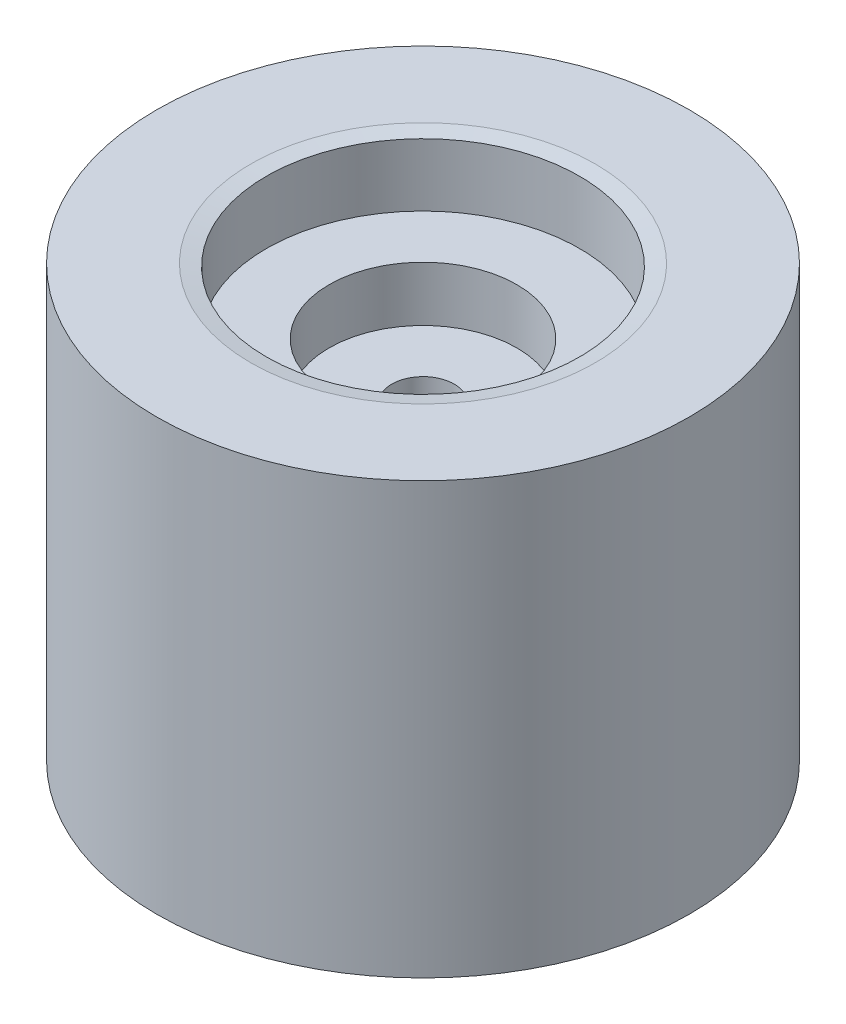
from build123d import *

# Parameters (mm, degrees)
CUT_EXTRUDE2_DEPTH = 0.2


with BuildPart() as part:
    # Sketch1 → Revolve1 (revolve)
    with BuildSketch(Plane.XY, mode=Mode.PRIVATE) as revolve1_sk:
        Polygon((34, 0), (22, 0), (20, 0.352653961), (20, 8.352653961), (12, 8.352653961), (12, 15.352653961), (4, 15.352653961), (4, 39.647346039), (12, 39.647346039), (12, 46.647346039), (20, 46.647346039), (20, 54.647346039), (22, 55), (34, 55), align=None)
    revolve(revolve1_sk.sketch.rotate(Axis((0, 45.813843283, 0), (0, -1, 0)), 90), axis=Axis((0, 45.813843283, 0), (0, -1, 0)))

    # Sketch3 → Cut-Extrude2 (cut)
    # profile 1 of 24: a face of its own
    with BuildSketch(Plane(origin=(0, 0, 0), x_dir=(-1, 0, 0), z_dir=(0, -1, 0))):
        Polygon((-0.64853766, -25.453725962), (-1.003305288, -25.430588942), (-0.919170673, -24.124399038), (-2.392928686, -25.340845353), (-2.86338141, -25.310697115), (-1.089543269, -23.856570513), (-2.768729968, -21.821213942), (-2.307391827, -21.850661058), (-0.883413462, -23.572616186), (-0.778245192, -21.949519231), (-0.423477564, -21.97265625), align=None)
    # profile 2 of 24: a face of its own
    with BuildSketch(Plane(origin=(0, 0, 0), x_dir=(-1, 0, 0), z_dir=(0, -1, 0))):
        Polygon((-3.725705974, -25.299033092), (-4.054532096, -25.247851201), (-3.506955974, -21.712795111), (-3.178129853, -21.763977002), align=None)
    # profile 3 of 24: a face of its own
    with BuildSketch(Plane(origin=(0, 0, 0), x_dir=(-1, 0, 0), z_dir=(0, -1, 0))):
        with BuildLine():
            Line((-7.333102932, -23.433666763), (-6.690875368, -20.930661955))
            Line((-6.690875368, -20.930661955), (-6.373267195, -21.011992083))
            Line((-6.373267195, -21.011992083), (-6.484044438, -21.442480865))
            add(Edge.make_bspline(
                [(-6.484044438, -21.442480865), (-6.439785056, -21.411811135), (-6.353385377, -21.351940103), (-6.215676766, -21.280336053), (-6.076898376, -21.22409492), (-5.93508951, -21.186195638), (-5.791435813, -21.163785225), (-5.645530585, -21.160208462), (-5.497562551, -21.17201912), (-5.400372757, -21.194227161), (-5.351031618, -21.205501699)],
                knots=[0, 0, 0, 0, 1.077446456, 2.103306094, 3.101073925, 4.070681639, 5.036452221, 6.005709679, 6.987542298, 8, 8, 8, 8], degree=3))
            add(Edge.make_bspline(
                [(-5.351031618, -21.205501699), (-5.307714003, -21.21765808), (-5.222401107, -21.24159975), (-5.1013166, -21.293179432), (-4.987514419, -21.354051058), (-4.882035749, -21.426851982), (-4.784079165, -21.509760778), (-4.694486601, -21.603899755), (-4.612989004, -21.708655115), (-4.541036823, -21.823184614), (-4.477828197, -21.943280623), (-4.428106944, -22.06764548), (-4.390996054, -22.194137163), (-4.3681293, -22.322980998), (-4.357293933, -22.454002214), (-4.360466662, -22.587387211), (-4.376292719, -22.722915595), (-4.396893249, -22.812630265), (-4.407321682, -22.858045769)],
                knots=[0, 0, 0, 0, 1.018862169, 2.006622056, 2.97605797, 3.939963702, 4.905847096, 5.880018755, 6.880327191, 7.909056975, 8.942101365, 9.952361419, 10.939794537, 11.924851773, 12.913364239, 13.914794192, 14.944423775, 16, 16, 16, 16], degree=3))
            add(Edge.make_bspline(
                [(-4.407321682, -22.858045769), (-4.41982181, -22.902016943), (-4.44448085, -22.988759008), (-4.495254368, -23.112726032), (-4.557548316, -23.228061729), (-4.629110389, -23.336423898), (-4.712530599, -23.435876859), (-4.805285289, -23.528680878), (-4.909943839, -23.612024115), (-5.023260674, -23.687104532), (-5.142636389, -23.75178243), (-5.265295227, -23.804271733), (-5.389824307, -23.842975294), (-5.515982232, -23.868521154), (-5.643829579, -23.880225313), (-5.773496412, -23.879784444), (-5.905073732, -23.864977926), (-5.992010891, -23.845348187), (-6.036027612, -23.835409551)],
                knots=[0, 0, 0, 0, 1.038758821, 2.04916259, 3.038102009, 4.01516508, 4.996193315, 5.984347323, 6.993422947, 8.032385596, 9.071348246, 10.076035557, 11.060883999, 12.031045428, 12.997021744, 13.974720322, 14.974590718, 16, 16, 16, 16], degree=3))
            add(Edge.make_bspline(
                [(-6.036027612, -23.835409551), (-6.085985032, -23.820926812), (-6.18392081, -23.792535066), (-6.321810986, -23.730469828), (-6.448372212, -23.654681674), (-6.562872417, -23.563147898), (-6.665860584, -23.45759986), (-6.755937066, -23.336748981), (-6.83533646, -23.202466106), (-6.876612981, -23.104913017), (-6.897706297, -23.055060994)],
                knots=[0, 0, 0, 0, 1.029958307, 2.019114804, 2.987563732, 3.946884547, 4.916562507, 5.902350563, 6.928049633, 8, 8, 8, 8], degree=3))
            Line((-6.897706297, -23.055060994), (-7.015494759, -23.514996891))
            Line((-7.015494759, -23.514996891), (-7.333102932, -23.433666763))
        make_face()
        with BuildLine():
            add(Edge.make_bspline(
                [(-5.981340112, -23.517801378), (-5.936898145, -23.527739588), (-5.848981083, -23.547399792), (-5.714335406, -23.554120074), (-5.580856868, -23.544786829), (-5.449682547, -23.516147963), (-5.322700975, -23.471880497), (-5.20328057, -23.409359545), (-5.092252128, -23.330800297), (-4.991225981, -23.236768715), (-4.901284247, -23.131398415), (-4.826463778, -23.016154134), (-4.766820322, -22.893326833), (-4.741267899, -22.806365311), (-4.728435464, -22.762693205)],
                knots=[0, 0, 0, 0, 1.006768039, 1.991633022, 2.97235635, 3.96194116, 4.955415077, 5.941421397, 6.936417096, 7.958116091, 8.989778792, 9.995948178, 10.993564502, 12, 12, 12, 12], degree=3))
            add(Edge.make_bspline(
                [(-4.728435464, -22.762693205), (-4.719103219, -22.718464002), (-4.700529554, -22.63043606), (-4.693183029, -22.494727318), (-4.704031734, -22.357871504), (-4.732217189, -22.2214342), (-4.775478424, -22.088951482), (-4.835654035, -21.965302744), (-4.910462852, -21.851777229), (-5.00051812, -21.750523162), (-5.10144779, -21.661707616), (-5.212226373, -21.587950845), (-5.331326154, -21.529124851), (-5.416255573, -21.504136935), (-5.459004374, -21.491559391)],
                knots=[0, 0, 0, 0, 1.000304671, 1.990873819, 2.99833525, 4.034071618, 5.07049366, 6.077808729, 7.071539232, 8.072968865, 9.070979518, 10.041729539, 11.014314276, 12, 12, 12, 12], degree=3))
            add(Edge.make_bspline(
                [(-5.459004374, -21.491559391), (-5.502985978, -21.481937782), (-5.590473732, -21.462798575), (-5.725359603, -21.455586592), (-5.860697081, -21.466654883), (-5.995328488, -21.493533677), (-6.124825105, -21.537548638), (-6.246333642, -21.596196321), (-6.355708401, -21.672744046), (-6.455012595, -21.762070365), (-6.540510639, -21.866106649), (-6.613559012, -21.981126975), (-6.67150986, -22.108225844), (-6.697826524, -22.198607401), (-6.7112079, -22.244564199)],
                knots=[0, 0, 0, 0, 0.993388131, 1.976037491, 2.970391249, 3.987029059, 5.000975524, 5.984655255, 6.957119043, 7.940365066, 8.926697105, 9.922243191, 10.943511798, 12, 12, 12, 12], degree=3))
            add(Edge.make_bspline(
                [(-6.7112079, -22.244564199), (-6.719653522, -22.280186097), (-6.736304685, -22.350417279), (-6.748264863, -22.456446342), (-6.751695253, -22.56018757), (-6.743637473, -22.661886514), (-6.726227026, -22.761479115), (-6.698795497, -22.859095077), (-6.660428132, -22.953998243), (-6.613263592, -23.045930922), (-6.557306164, -23.132358895), (-6.494768354, -23.212280356), (-6.425191163, -23.283946398), (-6.349097589, -23.347471242), (-6.266410146, -23.402395865), (-6.177576832, -23.449358427), (-6.082514765, -23.489442519), (-6.015468516, -23.50823532), (-5.981340112, -23.517801378)],
                knots=[0, 0, 0, 0, 1.071733142, 2.11300041, 3.119930696, 4.108819059, 5.096094072, 6.07803577, 7.073633984, 8.090364704, 9.100804401, 10.08572584, 11.059034916, 12.021663534, 12.984511304, 13.961666516, 14.96243158, 16, 16, 16, 16], degree=3))
        make_face(mode=Mode.SUBTRACT)
    # profile 4 of 24: a face of its own
    with BuildSketch(Plane(origin=(0, 0, 0), x_dir=(-1, 0, 0), z_dir=(0, -1, 0))):
        Polygon((-8.140756424, -23.175533038), (-8.466778059, -23.042319897), (-8.556521648, -20.981722942), (-10.055520046, -22.393782237), (-10.384346168, -22.259867974), (-8.319542482, -20.321266211), (-8.264854982, -20.343702109), align=None)
    # profile 5 of 24: a face of its own
    with BuildSketch(Plane(origin=(0, 0, 0), x_dir=(-1, 0, 0), z_dir=(0, -1, 0))):
        with BuildLine():
            Line((-12.175705553, -19.301197211), (-12.34607815, -19.034770929))
            add(Edge.make_bspline(
                [(-12.34607815, -19.034770929), (-12.304451209, -19.008527647), (-12.2237218, -18.957632609), (-12.098521393, -18.895957281), (-11.976055698, -18.847005812), (-11.854803126, -18.812223684), (-11.734548257, -18.790211313), (-11.614527992, -18.780533754), (-11.494601579, -18.781969185), (-11.374510563, -18.794380678), (-11.253867315, -18.820153491), (-11.132222339, -18.858182022), (-11.009420257, -18.90958917), (-10.929915717, -18.952943943), (-10.88914706, -18.975175577)],
                knots=[0, 0, 0, 0, 1.146396446, 2.223269474, 3.248075941, 4.21715249, 5.158561379, 6.093262783, 7.019463462, 7.950777074, 8.902782241, 9.89010865, 10.918081433, 12, 12, 12, 12], degree=3))
            add(Edge.make_bspline(
                [(-10.88914706, -18.975175577), (-10.845428039, -19.001781518), (-10.760084989, -19.053718458), (-10.64286562, -19.142377371), (-10.540231125, -19.23875099), (-10.450625689, -19.341632676), (-10.376215338, -19.452289864), (-10.314997408, -19.569709924), (-10.268928046, -19.69448783), (-10.236500658, -19.824383324), (-10.216314359, -19.956123848), (-10.208209888, -20.086788831), (-10.209648245, -20.214912534), (-10.224055077, -20.340451391), (-10.249254666, -20.463443696), (-10.285822532, -20.583951336), (-10.334285387, -20.701456648), (-10.374567153, -20.776447033), (-10.394856194, -20.814218045)],
                knots=[0, 0, 0, 0, 1.152937601, 2.250627084, 3.305173093, 4.320952387, 5.318723816, 6.303438932, 7.298426007, 8.308906654, 9.316045995, 10.297770193, 11.256519293, 12.199969192, 13.141019482, 14.082423473, 15.034158782, 16, 16, 16, 16], degree=3))
            add(Edge.make_bspline(
                [(-10.394856194, -20.814218045), (-10.415745908, -20.848978546), (-10.45694525, -20.917534288), (-10.528809307, -21.012429911), (-10.605747588, -21.100495888), (-10.689869246, -21.180786071), (-10.780156633, -21.254226212), (-10.87834001, -21.318117847), (-10.98155608, -21.376816582), (-11.054747535, -21.408278879), (-11.091771259, -21.424194006)],
                knots=[0, 0, 0, 0, 1.03044238, 2.032270484, 3.021668676, 4.000879558, 4.985484194, 5.975952392, 6.976140336, 8, 8, 8, 8], degree=3))
            add(Edge.make_bspline(
                [(-11.091771259, -21.424194006), (-11.13910152, -21.441881975), (-11.232303126, -21.476712695), (-11.376203954, -21.509415198), (-11.519269983, -21.52535395), (-11.661929995, -21.522888962), (-11.80395353, -21.504165977), (-11.945258088, -21.466965026), (-12.085882504, -21.412748014), (-12.175940944, -21.364648351), (-12.221979592, -21.340059391)],
                knots=[0, 0, 0, 0, 1.030087913, 2.02842418, 3.002174153, 3.960824671, 4.932704429, 5.91818976, 6.935760736, 8, 8, 8, 8], degree=3))
            add(Edge.make_bspline(
                [(-12.221979592, -21.340059391), (-12.267737617, -21.312034383), (-12.357357088, -21.257145949), (-12.478364883, -21.160064823), (-12.585451295, -21.054751108), (-12.676573531, -20.938669025), (-12.752649439, -20.81310452), (-12.814106072, -20.678158505), (-12.860194514, -20.533558158), (-12.878193648, -20.432833175), (-12.887344175, -20.381625897)],
                knots=[0, 0, 0, 0, 1.06307273, 2.082083174, 3.068409938, 4.035342472, 5.000173931, 5.972786504, 6.969390885, 8, 8, 8, 8], degree=3))
            add(Edge.make_bspline(
                [(-12.887344175, -20.381625897), (-12.892077117, -20.344523993), (-12.901546145, -20.270295527), (-12.902063673, -20.157567935), (-12.894085508, -20.044448815), (-12.874576161, -19.931010313), (-12.845863094, -19.816965226), (-12.806341616, -19.702577789), (-12.756368215, -19.587834477), (-12.716336326, -19.513137529), (-12.695937925, -19.475075417)],
                knots=[0, 0, 0, 0, 0.949996669, 1.900624725, 2.859772631, 3.829624316, 4.822404978, 5.846337876, 6.902593335, 8, 8, 8, 8], degree=3))
            Line((-12.695937925, -19.475075417), (-10.68231613, -20.627719647))
            add(Edge.make_bspline(
                [(-10.68231613, -20.627719647), (-10.66538064, -20.595035625), (-10.632223485, -20.531045203), (-10.592999094, -20.431880991), (-10.56235842, -20.333346664), (-10.542766106, -20.23462503), (-10.532720682, -20.136485846), (-10.532759346, -20.038530612), (-10.542625386, -19.940584239), (-10.562348406, -19.843964544), (-10.590032261, -19.75016045), (-10.626517278, -19.661227153), (-10.671915043, -19.578536768), (-10.723485924, -19.500289883), (-10.785323987, -19.429798677), (-10.853687157, -19.363916935), (-10.930258433, -19.303752448), (-10.986673494, -19.269984092), (-11.015348983, -19.252819808)],
                knots=[0, 0, 0, 0, 1.119256887, 2.191337375, 3.23943135, 4.254545933, 5.24783783, 6.236129562, 7.229421458, 8.237565065, 9.231848893, 10.201003839, 11.155441911, 12.09804831, 13.045842572, 14.001286459, 14.984064056, 16, 16, 16, 16], degree=3))
            add(Edge.make_bspline(
                [(-11.015348983, -19.252819808), (-11.044070201, -19.237329292), (-11.101496408, -19.206357015), (-11.19221494, -19.169520446), (-11.285991687, -19.140330047), (-11.381908099, -19.120819107), (-11.477462422, -19.107514842), (-11.570883626, -19.104494708), (-11.661081739, -19.107988504), (-11.750405745, -19.121990357), (-11.843433777, -19.146814007), (-11.945130787, -19.184885853), (-12.057506578, -19.237065173), (-12.134808268, -19.279007287), (-12.175705553, -19.301197211)],
                knots=[0, 0, 0, 0, 0.958960062, 1.917378241, 2.87382335, 3.842899795, 4.792481473, 5.70712857, 6.587734927, 7.443039805, 8.359827214, 9.414322366, 10.632019592, 12, 12, 12, 12], degree=3))
        make_face()
        with BuildLine():
            add(Edge.make_bspline(
                [(-12.521358598, -19.904863077), (-12.532477476, -19.947215593), (-12.553917386, -20.028881584), (-12.571408625, -20.149697091), (-12.576249949, -20.263018006), (-12.567524816, -20.369665024), (-12.543924, -20.471083074), (-12.50972407, -20.570240597), (-12.460999409, -20.666996681), (-12.402414199, -20.761918271), (-12.331506583, -20.850355756), (-12.252337768, -20.931159462), (-12.164860278, -21.003122019), (-12.100712839, -21.042566661), (-12.068433919, -21.06241516)],
                knots=[0, 0, 0, 0, 1.167082826, 2.250420627, 3.248398366, 4.18685002, 5.094128698, 6.018650023, 6.977557054, 7.977187896, 8.988583711, 9.993505539, 10.990334218, 12, 12, 12, 12], degree=3))
            add(Edge.make_bspline(
                [(-12.068433919, -21.06241516), (-12.041085766, -21.07713345), (-11.986973028, -21.106255963), (-11.903026789, -21.141270953), (-11.817934683, -21.167330456), (-11.732129851, -21.185849052), (-11.645211545, -21.19568665), (-11.557472005, -21.196689856), (-11.468810593, -21.191189504), (-11.410222516, -21.179697433), (-11.380633438, -21.173893526)],
                knots=[0, 0, 0, 0, 1.044742563, 2.067191927, 3.054836163, 4.035913521, 5.017369114, 5.992755354, 6.986269556, 8, 8, 8, 8], degree=3))
            add(Edge.make_bspline(
                [(-11.380633438, -21.173893526), (-11.358787096, -21.16867242), (-11.314280707, -21.158035741), (-11.248476435, -21.134431864), (-11.182145586, -21.105084021), (-11.116570593, -21.068064755), (-11.05006118, -21.026146808), (-10.984649285, -20.97659308), (-10.918008879, -20.921843104), (-10.875344776, -20.881336673), (-10.853389848, -20.860492083)],
                knots=[0, 0, 0, 0, 0.866837239, 1.765961323, 2.695157267, 3.664678394, 4.671134246, 5.72888785, 6.831286784, 8, 8, 8, 8], degree=3))
            Line((-10.853389848, -20.860492083), (-12.521358598, -19.904863077))
        make_face(mode=Mode.SUBTRACT)
    # profile 6 of 24: a face of its own
    with BuildSketch(Plane(origin=(0, 0, 0), x_dir=(-1, 0, 0), z_dir=(0, -1, 0))):
        with BuildLine():
            Line((-13.977400223, -20.217974213), (-14.25364221, -20.018855623))
            Line((-14.25364221, -20.018855623), (-14.032788844, -19.712465398))
            add(Edge.make_bspline(
                [(-14.032788844, -19.712465398), (-14.073724611, -19.726195353), (-14.152670287, -19.752673923), (-14.270090841, -19.780620079), (-14.381524555, -19.794700717), (-14.486416758, -19.797467391), (-14.584880938, -19.787304853), (-14.676319831, -19.763736495), (-14.761858136, -19.72905446), (-14.812893946, -19.6960119), (-14.838377787, -19.679512674)],
                knots=[0, 0, 0, 0, 1.234285451, 2.380351193, 3.444667928, 4.440615088, 5.37492502, 6.264774163, 7.133545273, 8, 8, 8, 8], degree=3))
            add(Edge.make_bspline(
                [(-14.838377787, -19.679512674), (-14.856642842, -19.664850935), (-14.894322947, -19.634604333), (-14.942804917, -19.577203918), (-14.988495272, -19.511107783), (-15.01289758, -19.46136778), (-15.025577306, -19.435522289)],
                knots=[0, 0, 0, 0, 0.902919608, 1.862688329, 2.889427707, 4, 4, 4, 4], degree=3))
            Line((-15.025577306, -19.435522289), (-14.720589325, -19.310021488))
            add(Edge.make_bspline(
                [(-14.720589325, -19.310021488), (-14.711267134, -19.325155576), (-14.693457257, -19.354068975), (-14.664247957, -19.392219386), (-14.635396182, -19.424047876), (-14.614690948, -19.440885149), (-14.604904229, -19.448843604)],
                knots=[0, 0, 0, 0, 1.17267859, 2.240381019, 3.168282925, 4, 4, 4, 4], degree=3))
            add(Edge.make_bspline(
                [(-14.604904229, -19.448843604), (-14.581358934, -19.463696145), (-14.533789442, -19.493703325), (-14.450911017, -19.519756324), (-14.36036537, -19.531399047), (-14.261850038, -19.528379464), (-14.156450389, -19.508126899), (-14.047409664, -19.464848129), (-13.934768877, -19.402062527), (-13.862939075, -19.347670439), (-13.825256793, -19.319136072)],
                knots=[0, 0, 0, 0, 0.784902642, 1.585769919, 2.43303717, 3.359153456, 4.362891489, 5.453379249, 6.664029727, 8, 8, 8, 8], degree=3))
            add(Edge.make_bspline(
                [(-13.825256793, -19.319136072), (-13.808916566, -19.305346685), (-13.772863981, -19.274922197), (-13.718691911, -19.219257782), (-13.656937256, -19.152153844), (-13.589410179, -19.071779565), (-13.513929292, -18.979816263), (-13.432537761, -18.874763017), (-13.34371134, -18.757546548), (-13.283802227, -18.674243137), (-13.252440287, -18.630634469)],
                knots=[0, 0, 0, 0, 0.571459953, 1.260852033, 2.074749343, 3.010217833, 4.067316727, 5.256215779, 6.563650926, 8, 8, 8, 8], degree=3))
            Line((-13.252440287, -18.630634469), (-12.740621377, -17.921099213))
            Line((-12.740621377, -17.921099213), (-12.464379389, -18.120217802))
            Line((-12.464379389, -18.120217802), (-13.977400223, -20.217974213))
        make_face()
    # profile 7 of 24: a face of its own
    with BuildSketch(Plane(origin=(0, 0, 0), x_dir=(-1, 0, 0), z_dir=(0, -1, 0))):
        Polygon((-17.171474312, -18.763385585), (-17.413361332, -18.501867156), (-16.058092902, -16.284920041), (-18.569511171, -17.253870361), (-18.617187453, -17.201987348), (-17.450520787, -14.781013791), (-19.774739537, -15.95258831), (-20.015224312, -15.692472124), (-16.792167421, -14.064467316), (-16.747295627, -14.11284472), (-17.974959889, -16.652307861), (-15.335236332, -15.637784624), (-15.290364537, -15.686162028), align=None)
    # profile 8 of 24: a face of its own
    with BuildSketch(Plane(origin=(0, 0, 0), x_dir=(-1, 0, 0), z_dir=(0, -1, 0))):
        with BuildLine():
            Line((-20.84246771, -14.787038315), (-21.023357133, -14.507991841))
            Line((-21.023357133, -14.507991841), (-19.797095114, -13.715023091))
            add(Edge.make_bspline(
                [(-19.797095114, -13.715023091), (-19.850756031, -13.709743254), (-19.955355539, -13.699451437), (-20.10593832, -13.667230143), (-20.244972921, -13.620675145), (-20.373001548, -13.561753656), (-20.490053424, -13.48921564), (-20.594445441, -13.40201086), (-20.689848066, -13.303509623), (-20.74182228, -13.228086813), (-20.7681488, -13.189882866)],
                knots=[0, 0, 0, 0, 1.127687986, 2.198166054, 3.214231065, 4.1900964, 5.141350964, 6.086248287, 7.030626571, 8, 8, 8, 8], degree=3))
            add(Edge.make_bspline(
                [(-20.7681488, -13.189882866), (-20.79224861, -13.149365883), (-20.839453744, -13.070003867), (-20.888943143, -12.94204318), (-20.917965145, -12.811068967), (-20.927087453, -12.678238089), (-20.916572254, -12.546922715), (-20.887510599, -12.419600709), (-20.840017644, -12.297860756), (-20.784829981, -12.201127975), (-20.728587616, -12.125825618), (-20.677542659, -12.066070359), (-20.615903045, -12.005717503), (-20.546635146, -11.941999224), (-20.466709497, -11.878298657), (-20.37937526, -11.810361465), (-20.281588064, -11.742056031), (-20.212740075, -11.696787977), (-20.177103127, -11.673356424)],
                knots=[0, 0, 0, 0, 1.218598839, 2.386911691, 3.53318519, 4.679203266, 5.82008484, 6.930950139, 8.047581768, 9.19107448, 9.800854183, 10.478645187, 11.222929712, 12.032292783, 12.913768633, 13.867199649, 14.896024444, 16, 16, 16, 16], degree=3))
            Line((-20.177103127, -11.673356424), (-19.060216107, -10.950499854))
            Line((-19.060216107, -10.950499854), (-18.879326684, -11.229546328))
            Line((-18.879326684, -11.229546328), (-19.914182453, -11.899117642))
            add(Edge.make_bspline(
                [(-19.914182453, -11.899117642), (-19.944091199, -11.918756277), (-20.001198906, -11.956254252), (-20.082947081, -12.009759228), (-20.155125512, -12.060760867), (-20.219665267, -12.106674168), (-20.275765716, -12.148758773), (-20.323814682, -12.186448313), (-20.362956575, -12.220578403), (-20.385647296, -12.242584932), (-20.395853127, -12.252483027)],
                knots=[0, 0, 0, 0, 1.435382595, 2.740716969, 3.91892286, 4.980454357, 5.917992341, 6.732086325, 7.429717908, 8, 8, 8, 8], degree=3))
            add(Edge.make_bspline(
                [(-20.395853127, -12.252483027), (-20.42373696, -12.283952671), (-20.47712486, -12.344206159), (-20.538528722, -12.444137156), (-20.580261812, -12.54590857), (-20.6012649, -12.65041245), (-20.60106122, -12.756649685), (-20.579885512, -12.864479926), (-20.53754061, -12.973626118), (-20.496479493, -13.042967398), (-20.475079889, -13.079105623)],
                knots=[0, 0, 0, 0, 1.109545137, 2.124395311, 3.083267542, 4.002674317, 4.922993531, 5.872710783, 6.891332008, 8, 8, 8, 8], degree=3))
            add(Edge.make_bspline(
                [(-20.475079889, -13.079105623), (-20.461265052, -13.099771388), (-20.433897894, -13.140710216), (-20.385473418, -13.195756798), (-20.334278791, -13.246789283), (-20.278583015, -13.292477807), (-20.218760265, -13.333313413), (-20.154659805, -13.369078853), (-20.086555881, -13.400216818), (-20.014478541, -13.424802121), (-19.941061788, -13.445307499), (-19.866910397, -13.459191581), (-19.793122604, -13.467956442), (-19.719470569, -13.469824677), (-19.646117527, -13.466326339), (-19.572928367, -13.45728382), (-19.499999642, -13.441924875), (-19.452276131, -13.427231275), (-19.42830505, -13.419850815)],
                knots=[0, 0, 0, 0, 1.007037932, 1.994939611, 2.966706709, 3.936299156, 4.911572451, 5.900246692, 6.90973457, 7.943836999, 8.985382846, 9.998423706, 11.000050662, 11.995605869, 12.982415844, 13.975758051, 14.983241871, 16, 16, 16, 16], degree=3))
            add(Edge.make_bspline(
                [(-19.42830505, -13.419850815), (-19.411640057, -13.413721058), (-19.3750383, -13.400258113), (-19.317263202, -13.374146629), (-19.252005222, -13.340537887), (-19.178429739, -13.301768975), (-19.097986335, -13.254933274), (-19.009425195, -13.202467002), (-18.913411023, -13.142767084), (-18.847241657, -13.100010254), (-18.812720114, -13.077703379)],
                knots=[0, 0, 0, 0, 0.603847095, 1.32624506, 2.154595282, 3.100584172, 4.15463332, 5.320283954, 6.601952221, 8, 8, 8, 8], degree=3))
            Line((-18.812720114, -13.077703379), (-18.016946877, -12.563079982))
            Line((-18.016946877, -12.563079982), (-17.836057453, -12.842126456))
            Line((-17.836057453, -12.842126456), (-20.84246771, -14.787038315))
        make_face()
    # profile 9 of 24: a face of its own
    with BuildSketch(Plane(origin=(0, 0, 0), x_dir=(-1, 0, 0), z_dir=(0, -1, 0))):
        with BuildLine():
            Line((-21.085268733, -8.72427279), (-21.069844053, -8.409469104))
            add(Edge.make_bspline(
                [(-21.069844053, -8.409469104), (-21.020914015, -8.412110904), (-20.925912947, -8.417240141), (-20.788595228, -8.438995087), (-20.660249773, -8.468821171), (-20.541651783, -8.511857704), (-20.430830226, -8.563105143), (-20.326961543, -8.62378312), (-20.230021944, -8.694061807), (-20.139757685, -8.773984842), (-20.055311433, -8.863442028), (-19.979366138, -8.96505405), (-19.909026861, -9.077220514), (-19.869491433, -9.158102532), (-19.849191008, -9.199633367)],
                knots=[0, 0, 0, 0, 1.1446473, 2.222412267, 3.245271118, 4.219782991, 5.165608623, 6.095958248, 7.026933134, 7.959653325, 8.91038812, 9.896966874, 10.920146594, 12, 12, 12, 12], degree=3))
            add(Edge.make_bspline(
                [(-19.849191008, -9.199633367), (-19.828629483, -9.246482309), (-19.788477756, -9.337967051), (-19.745215231, -9.478116177), (-19.716467223, -9.615668126), (-19.703660835, -9.751127069), (-19.70622125, -9.88434075), (-19.724980677, -10.015035287), (-19.757512464, -10.143624853), (-19.807615016, -10.267533694), (-19.867143234, -10.386351025), (-19.935640402, -10.497428188), (-20.010407331, -10.600745712), (-20.094792429, -10.694130369), (-20.185716661, -10.780200986), (-20.285411953, -10.856626529), (-20.391967508, -10.925540846), (-20.468337317, -10.962998623), (-20.506843252, -10.98188497)],
                knots=[0, 0, 0, 0, 1.154959887, 2.255359564, 3.306268758, 4.324348896, 5.322369712, 6.308648037, 7.301011602, 8.310790168, 9.321299912, 10.300089347, 11.255710248, 12.197893265, 13.139099574, 14.079980089, 15.031918992, 16, 16, 16, 16], degree=3))
            add(Edge.make_bspline(
                [(-20.506843252, -10.98188497), (-20.54372244, -10.998271268), (-20.616764647, -11.030725654), (-20.730111774, -11.066193949), (-20.843480643, -11.094558388), (-20.958344441, -11.111079995), (-21.074189486, -11.118127842), (-21.19102393, -11.115430576), (-21.30850894, -11.102016312), (-21.386153551, -11.086010846), (-21.425312803, -11.077938656)],
                knots=[0, 0, 0, 0, 1.028100337, 2.03623566, 3.023319322, 4.005046937, 4.990024118, 5.979443056, 6.980953103, 8, 8, 8, 8], degree=3))
            add(Edge.make_bspline(
                [(-21.425312803, -11.077938656), (-21.474299576, -11.065073283), (-21.570562956, -11.039791678), (-21.706480527, -10.982583467), (-21.832257909, -10.913363651), (-21.946994759, -10.829276517), (-22.052180697, -10.732489977), (-22.145416754, -10.6204501), (-22.229377573, -10.495741717), (-22.274467292, -10.404507578), (-22.297508316, -10.357886572)],
                knots=[0, 0, 0, 0, 1.03446602, 2.032818041, 3.006107678, 3.963823487, 4.934293692, 5.921189589, 6.937719682, 8, 8, 8, 8], degree=3))
            add(Edge.make_bspline(
                [(-22.297508316, -10.357886572), (-22.318635525, -10.308729029), (-22.360071844, -10.21231745), (-22.403681476, -10.063514897), (-22.429525432, -9.91553637), (-22.436164534, -9.768406481), (-22.426912016, -9.622355864), (-22.397923085, -9.477551634), (-22.352637358, -9.3333126), (-22.309137777, -9.241014656), (-22.286991489, -9.194024393)],
                knots=[0, 0, 0, 0, 1.062543402, 2.083942372, 3.073494355, 4.040645805, 5.004233345, 5.974290983, 6.968681242, 8, 8, 8, 8], degree=3))
            add(Edge.make_bspline(
                [(-22.286991489, -9.194024393), (-22.269470619, -9.16087713), (-22.234511618, -9.094739134), (-22.169291894, -9.003074892), (-22.097977575, -8.915347074), (-22.016841393, -8.833762955), (-21.926584378, -8.758424831), (-21.829066356, -8.686904971), (-21.721897441, -8.622497526), (-21.646192689, -8.584490885), (-21.60760447, -8.565118143)],
                knots=[0, 0, 0, 0, 0.952977786, 1.901455369, 2.856212483, 3.827510491, 4.823379909, 5.845082124, 6.901595453, 8, 8, 8, 8], degree=3))
            Line((-21.60760447, -8.565118143), (-20.633045175, -10.664977919))
            add(Edge.make_bspline(
                [(-20.633045175, -10.664977919), (-20.600517282, -10.647939649), (-20.536681645, -10.61450223), (-20.447307696, -10.556883495), (-20.366167788, -10.493451556), (-20.293132932, -10.424723971), (-20.227976069, -10.350779365), (-20.171720209, -10.270894225), (-20.123014073, -10.185830113), (-20.083321912, -10.095737434), (-20.053019892, -10.003083238), (-20.030285667, -9.909893074), (-20.019707682, -9.816456411), (-20.016941953, -9.723202171), (-20.025784018, -9.630114409), (-20.044214458, -9.537156162), (-20.072132034, -9.44401426), (-20.098172581, -9.383793089), (-20.11141056, -9.35317904)],
                knots=[0, 0, 0, 0, 1.119462927, 2.196933836, 3.237760628, 4.256262455, 5.251275377, 6.238085673, 7.230875214, 8.236072564, 9.234551198, 10.200970867, 11.155756059, 12.096821897, 13.041524484, 14.00042429, 14.983495238, 16, 16, 16, 16], degree=3))
            add(Edge.make_bspline(
                [(-20.11141056, -9.35317904), (-20.125755106, -9.323857109), (-20.15429945, -9.265509133), (-20.208056628, -9.184050841), (-20.267485303, -9.10664222), (-20.333733877, -9.034909527), (-20.404801508, -8.970216342), (-20.478578265, -8.913093912), (-20.55438049, -8.864327286), (-20.635034076, -8.823492154), (-20.725319535, -8.790068181), (-20.830190208, -8.76212481), (-20.952030754, -8.740589453), (-21.039171056, -8.729918029), (-21.085268733, -8.72427279)],
                knots=[0, 0, 0, 0, 0.961020865, 1.912344096, 2.869730571, 3.834740829, 4.785365804, 5.698660785, 6.581293917, 7.437523325, 8.357235462, 9.413076227, 10.631503763, 12, 12, 12, 12], degree=3))
        make_face()
        with BuildLine():
            add(Edge.make_bspline(
                [(-21.714174983, -9.016640579), (-21.747768645, -9.044697228), (-21.81222492, -9.098529616), (-21.895240469, -9.18743103), (-21.965104797, -9.27592518), (-22.018764049, -9.368156803), (-22.05821615, -9.463917027), (-22.087684319, -9.564163868), (-22.103683626, -9.670941585), (-22.110422509, -9.782007289), (-22.104011187, -9.894674811), (-22.085378763, -10.005972927), (-22.055949475, -10.114952766), (-22.026305058, -10.184310295), (-22.011450624, -10.219064457)],
                knots=[0, 0, 0, 0, 1.170277559, 2.245415569, 3.248732248, 4.182016471, 5.090363297, 6.014782261, 6.971066968, 7.973369407, 8.988161353, 9.983492395, 10.989554078, 12, 12, 12, 12], degree=3))
            add(Edge.make_bspline(
                [(-22.011450624, -10.219064457), (-21.997647392, -10.24688704), (-21.970494269, -10.301618426), (-21.922330359, -10.378722371), (-21.868574418, -10.449374752), (-21.809014486, -10.513750048), (-21.744460828, -10.572241149), (-21.673925522, -10.624203138), (-21.598008598, -10.670317231), (-21.543837388, -10.695180278), (-21.516458636, -10.707746348)],
                knots=[0, 0, 0, 0, 1.046637035, 2.058899262, 3.059595923, 4.035383929, 5.011680787, 5.991880627, 6.985073397, 8, 8, 8, 8], degree=3))
            add(Edge.make_bspline(
                [(-21.516458636, -10.707746348), (-21.495553443, -10.716053651), (-21.453188044, -10.732888809), (-21.386074261, -10.75180093), (-21.315155878, -10.764809332), (-21.240653803, -10.773200078), (-21.162419526, -10.776617114), (-21.080495772, -10.77500231), (-20.99452303, -10.768964221), (-20.936353231, -10.760480299), (-20.906482675, -10.756123752)],
                knots=[0, 0, 0, 0, 0.870657413, 1.764429949, 2.694485118, 3.65988393, 4.665422574, 5.724395687, 6.831462903, 8, 8, 8, 8], degree=3))
            Line((-20.906482675, -10.756123752), (-21.714174983, -9.016640579))
        make_face(mode=Mode.SUBTRACT)
    # profile 10 of 24: a face of its own
    with BuildSketch(Plane(origin=(0, 0, 0), x_dir=(-1, 0, 0), z_dir=(0, -1, 0))):
        with BuildLine():
            Line((-22.103954482, -5.644248692), (-22.043658007, -5.336456224))
            add(Edge.make_bspline(
                [(-22.043658007, -5.336456224), (-21.995786253, -5.345919198), (-21.902850516, -5.364290124), (-21.770540403, -5.404604724), (-21.648995533, -5.453500645), (-21.538353957, -5.512319289), (-21.436458714, -5.578657847), (-21.342746761, -5.653047196), (-21.257747262, -5.736406351), (-21.179933815, -5.827397826), (-21.109876875, -5.927598857), (-21.049152313, -6.038265942), (-20.996035533, -6.158867373), (-20.968328687, -6.244135113), (-20.954114738, -6.287878499)],
                knots=[0, 0, 0, 0, 1.14611032, 2.224999012, 3.244837011, 4.220139754, 5.164554414, 6.098580607, 7.026776164, 7.957826817, 8.908496211, 9.894257274, 10.919728395, 12, 12, 12, 12], degree=3))
            add(Edge.make_bspline(
                [(-20.954114738, -6.287878499), (-20.940458164, -6.336957678), (-20.913791968, -6.43279101), (-20.892071555, -6.57723268), (-20.882896738, -6.716644233), (-20.888997892, -6.851943361), (-20.910787312, -6.982789582), (-20.947663084, -7.108986613), (-20.9982864, -7.230950021), (-21.064587474, -7.34615731), (-21.140466966, -7.454592863), (-21.223603438, -7.554621955), (-21.312429788, -7.6455464), (-21.408616886, -7.725812106), (-21.510675081, -7.79687557), (-21.618926196, -7.859156802), (-21.734325734, -7.910349237), (-21.814616532, -7.936877102), (-21.855056245, -7.950238275)],
                knots=[0, 0, 0, 0, 1.155351233, 2.255970112, 3.308214833, 4.322524108, 5.322795804, 6.31158015, 7.300691713, 8.312640155, 9.322152562, 10.301543734, 11.261814361, 12.203173939, 13.140549447, 14.081430631, 15.033682618, 16, 16, 16, 16], degree=3))
            add(Edge.make_bspline(
                [(-21.855056245, -7.950238275), (-21.893697142, -7.960929347), (-21.970310859, -7.982126647), (-22.086948807, -8.002395025), (-22.203069089, -8.011855218), (-22.318482882, -8.013215173), (-22.433332938, -8.002686563), (-22.547900142, -7.984155553), (-22.661944838, -7.954671376), (-22.736104915, -7.927493693), (-22.773525796, -7.913779942)],
                knots=[0, 0, 0, 0, 1.026645007, 2.035539934, 3.026945497, 4.008832766, 4.988307711, 5.977487245, 6.979448103, 8, 8, 8, 8], degree=3))
            add(Edge.make_bspline(
                [(-22.773525796, -7.913779942), (-22.819858281, -7.894292911), (-22.911053039, -7.855937209), (-23.036900653, -7.780652454), (-23.15082967, -7.694173868), (-23.251852583, -7.595031459), (-23.340759689, -7.484138842), (-23.417432312, -7.361345684), (-23.4820716, -7.226347207), (-23.513800411, -7.130098318), (-23.530036213, -7.080847249)],
                knots=[0, 0, 0, 0, 1.031981375, 2.031216134, 3.004401432, 3.96564799, 4.932590092, 5.918810098, 6.93504405, 8, 8, 8, 8], degree=3))
            add(Edge.make_bspline(
                [(-23.530036213, -7.080847249), (-23.544079627, -7.029455159), (-23.571631389, -6.928629068), (-23.591974899, -6.775796165), (-23.596891748, -6.626511335), (-23.583624552, -6.480692819), (-23.552177241, -6.338398467), (-23.504226709, -6.199504536), (-23.438850316, -6.063842639), (-23.383097693, -5.979029994), (-23.354755764, -5.935915358)],
                knots=[0, 0, 0, 0, 1.063062397, 2.085621052, 3.070936632, 4.041244408, 5.001700287, 5.974508644, 6.970338426, 8, 8, 8, 8], degree=3))
            add(Edge.make_bspline(
                [(-23.354755764, -5.935915358), (-23.332621374, -5.90603675), (-23.288322851, -5.846239385), (-23.212082897, -5.764164164), (-23.128182248, -5.689093239), (-23.037233143, -5.619745734), (-22.938306304, -5.55764731), (-22.831756589, -5.501839157), (-22.717363549, -5.453585803), (-22.637468182, -5.42706492), (-22.596843104, -5.413579621)],
                knots=[0, 0, 0, 0, 0.951073619, 1.90342526, 2.860591661, 3.829551874, 4.826840063, 5.846125729, 6.904801207, 8, 8, 8, 8], degree=3))
            Line((-22.596843104, -5.413579621), (-21.934283007, -7.620711031))
            add(Edge.make_bspline(
                [(-21.934283007, -7.620711031), (-21.899686404, -7.608698558), (-21.831978048, -7.585189174), (-21.736117146, -7.54017233), (-21.646644888, -7.49022854), (-21.565073016, -7.432408766), (-21.490956533, -7.36820993), (-21.424055602, -7.297755337), (-21.363930878, -7.220884313), (-21.31212396, -7.137921856), (-21.267439476, -7.051499217), (-21.234241544, -6.962035689), (-21.209065812, -6.871827606), (-21.194376157, -6.78012141), (-21.189365585, -6.687035784), (-21.194754209, -6.592923039), (-21.208214971, -6.497110359), (-21.225657693, -6.434254028), (-21.234563456, -6.402161352)],
                knots=[0, 0, 0, 0, 1.121233271, 2.194344354, 3.239578914, 4.256651736, 5.251455957, 6.238993923, 7.228631906, 8.235726978, 9.231535493, 10.203587452, 11.153664475, 12.096483935, 13.04288497, 14.003585503, 14.980686843, 16, 16, 16, 16], degree=3))
            add(Edge.make_bspline(
                [(-21.234563456, -6.402161352), (-21.244729113, -6.371322337), (-21.264953605, -6.309968367), (-21.305689638, -6.221955044), (-21.353408501, -6.13744827), (-21.408638578, -6.057479589), (-21.468896875, -5.982936251), (-21.533572306, -5.916238954), (-21.60115563, -5.857183454), (-21.674966072, -5.805942671), (-21.759235396, -5.759814749), (-21.858497662, -5.717347981), (-21.975340171, -5.678725447), (-22.059422793, -5.656185996), (-22.103954482, -5.644248692)],
                knots=[0, 0, 0, 0, 0.96108236, 1.91206559, 2.866820282, 3.832602582, 4.787206702, 5.702632973, 6.581091468, 7.441361589, 8.358435181, 9.421880798, 10.634581077, 12, 12, 12, 12], degree=3))
        make_face()
        with BuildLine():
            add(Edge.make_bspline(
                [(-22.765112334, -5.84266616), (-22.801998326, -5.865871937), (-22.872852343, -5.910447736), (-22.968486247, -5.985045201), (-23.048879736, -6.063664518), (-23.115485642, -6.146171236), (-23.169266202, -6.234307661), (-23.211187629, -6.329435262), (-23.242699558, -6.432096949), (-23.26414494, -6.540615301), (-23.274863331, -6.652460521), (-23.272641716, -6.764857425), (-23.258200675, -6.876420965), (-23.238946407, -6.94897522), (-23.229254963, -6.985494685)],
                knots=[0, 0, 0, 0, 1.170504252, 2.248412588, 3.252030804, 4.185722181, 5.090431357, 6.018190439, 6.971630846, 7.970463194, 8.985918276, 9.984612419, 10.985574645, 12, 12, 12, 12], degree=3))
            add(Edge.make_bspline(
                [(-23.229254963, -6.985494685), (-23.219745448, -7.014909466), (-23.20102526, -7.072814654), (-23.163945811, -7.155236053), (-23.12136249, -7.232625494), (-23.072039709, -7.304473428), (-23.016222605, -7.371004281), (-22.953716874, -7.431707324), (-22.885374476, -7.48783202), (-22.835780148, -7.520198745), (-22.810685251, -7.536576416)],
                knots=[0, 0, 0, 0, 1.046833148, 2.060769095, 3.056858374, 4.03653733, 5.008923488, 5.994537819, 6.985229398, 8, 8, 8, 8], degree=3))
            add(Edge.make_bspline(
                [(-22.810685251, -7.536576416), (-22.791228706, -7.547662707), (-22.75176343, -7.570149922), (-22.688388623, -7.598078352), (-22.620528085, -7.62120537), (-22.548316347, -7.639992755), (-22.471719921, -7.654603677), (-22.390746197, -7.665260225), (-22.305253924, -7.670676551), (-22.246756301, -7.671017438), (-22.216835091, -7.671191801)],
                knots=[0, 0, 0, 0, 0.871127491, 1.766978039, 2.690343646, 3.658884452, 4.668579668, 5.723478566, 6.835571909, 8, 8, 8, 8], degree=3))
            Line((-22.216835091, -7.671191801), (-22.765112334, -5.84266616))
        make_face(mode=Mode.SUBTRACT)
    # profile 11 of 24: a face of its own
    with BuildSketch(Plane(origin=(0, 0, 0), x_dir=(-1, 0, 0), z_dir=(0, -1, 0))):
        Polygon((-25.03223864, -5.205780789), (-25.098144089, -4.880460277), (-21.596040723, -4.174430629), (-21.530135275, -4.499751142), align=None)
    # profile 12 of 24: a face of its own
    with BuildSketch(Plane(origin=(0, 0, 0), x_dir=(-1, 0, 0), z_dir=(0, -1, 0))):
        with BuildLine():
            Line((-24.153078779, -2.500120362), (-23.906985029, -2.682412029))
            add(Edge.make_bspline(
                [(-23.906985029, -2.682412029), (-23.924420439, -2.706702415), (-23.958059555, -2.753567225), (-24.001020352, -2.825977042), (-24.037161036, -2.896398454), (-24.064752171, -2.965885967), (-24.083780465, -3.034114862), (-24.096130233, -3.100472494), (-24.099999208, -3.166024275), (-24.096116144, -3.208739722), (-24.094184548, -3.229988151)],
                knots=[0, 0, 0, 0, 1.209508741, 2.333573268, 3.403701757, 4.410073861, 5.353264341, 6.266042272, 7.137457774, 8, 8, 8, 8], degree=3))
            add(Edge.make_bspline(
                [(-24.094184548, -3.229988151), (-24.089553207, -3.255494945), (-24.080458544, -3.305583172), (-24.0501283, -3.375455517), (-24.007280191, -3.43738245), (-23.953575763, -3.490199564), (-23.89264449, -3.531756819), (-23.827857417, -3.561205756), (-23.759282207, -3.574373494), (-23.713501342, -3.571490752), (-23.690338394, -3.570032221)],
                knots=[0, 0, 0, 0, 1.062835051, 2.087111511, 3.102383268, 4.14173099, 5.164925658, 6.119864611, 7.048740606, 8, 8, 8, 8], degree=3))
            add(Edge.make_bspline(
                [(-23.690338394, -3.570032221), (-23.67000563, -3.566153059), (-23.628746299, -3.558281446), (-23.570358393, -3.531358966), (-23.515157443, -3.49329852), (-23.482798809, -3.461210269), (-23.46597942, -3.44453142)],
                knots=[0, 0, 0, 0, 0.944776156, 1.917143687, 2.917371736, 4, 4, 4, 4], degree=3))
            add(Edge.make_bspline(
                [(-23.46597942, -3.44453142), (-23.457104714, -3.434662641), (-23.438117818, -3.413548989), (-23.412639341, -3.375651901), (-23.386035426, -3.331754828), (-23.359657874, -3.280924566), (-23.332170829, -3.223935199), (-23.304321619, -3.160337502), (-23.276119049, -3.090006528), (-23.258505625, -3.040517168), (-23.249332785, -3.014743759)],
                knots=[0, 0, 0, 0, 0.657324378, 1.406305613, 2.258827884, 3.202188995, 4.243897338, 5.395724111, 6.643727354, 8, 8, 8, 8], degree=3))
            add(Edge.make_bspline(
                [(-23.249332785, -3.014743759), (-23.237565254, -2.983369474), (-23.214793379, -2.922655696), (-23.179346588, -2.835658133), (-23.142703754, -2.756202937), (-23.106107685, -2.684039307), (-23.067739686, -2.619672363), (-23.029520069, -2.562468489), (-22.991332743, -2.511888808), (-22.963326511, -2.4830441), (-22.949953779, -2.469271003)],
                knots=[0, 0, 0, 0, 1.282845994, 2.482492417, 3.595458468, 4.631885061, 5.578657253, 6.462092433, 7.265662522, 8, 8, 8, 8], degree=3))
            add(Edge.make_bspline(
                [(-22.949953779, -2.469271003), (-22.922393033, -2.445382556), (-22.868025289, -2.398258977), (-22.773978523, -2.34486692), (-22.673272413, -2.304902715), (-22.601821901, -2.292527673), (-22.565739035, -2.286278215)],
                knots=[0, 0, 0, 0, 1.009975439, 1.992329457, 2.986116359, 4, 4, 4, 4], degree=3))
            add(Edge.make_bspline(
                [(-22.565739035, -2.286278215), (-22.539831127, -2.283378518), (-22.489048578, -2.277694772), (-22.413149413, -2.278883115), (-22.339661136, -2.286370578), (-22.267902095, -2.301125032), (-22.19850287, -2.323864562), (-22.130768844, -2.353079586), (-22.065958196, -2.391070571), (-22.003463754, -2.43475213), (-21.94460168, -2.483873676), (-21.892632308, -2.539261955), (-21.846345512, -2.598096317), (-21.805437969, -2.660993685), (-21.77301499, -2.729196317), (-21.746388722, -2.801300362), (-21.724571144, -2.877330315), (-21.716560368, -2.93025379), (-21.712473811, -2.957251772)],
                knots=[0, 0, 0, 0, 1.032226439, 2.023285282, 3.001099205, 3.956549998, 4.920180748, 5.89068595, 6.87405481, 7.891549944, 8.910224687, 9.906032695, 10.89544562, 11.874311711, 12.872614728, 13.880750953, 14.918902276, 16, 16, 16, 16], degree=3))
            add(Edge.make_bspline(
                [(-21.712473811, -2.957251772), (-21.708865279, -2.993667149), (-21.701656996, -3.066409284), (-21.705279001, -3.176197364), (-21.722679112, -3.284949325), (-21.751174053, -3.391700921), (-21.790879646, -3.494228824), (-21.840817021, -3.590405), (-21.901355568, -3.679004597), (-21.949277369, -3.731584783), (-21.973291119, -3.757932862)],
                knots=[0, 0, 0, 0, 1.007795938, 2.013139388, 3.017058063, 4.037333022, 5.052879931, 6.041074472, 7.018376926, 8, 8, 8, 8], degree=3))
            Line((-21.973291119, -3.757932862), (-22.23551067, -3.583353535))
            add(Edge.make_bspline(
                [(-22.23551067, -3.583353535), (-22.215722489, -3.559584194), (-22.177428241, -3.513585571), (-22.128044146, -3.441640906), (-22.087569293, -3.369955911), (-22.056680784, -3.297938389), (-22.033511624, -3.226473485), (-22.021251232, -3.154755259), (-22.016164686, -3.083620381), (-22.020775862, -3.036695323), (-22.023070766, -3.013341516)],
                knots=[0, 0, 0, 0, 1.182606553, 2.288589813, 3.333214104, 4.32633851, 5.282059647, 6.199245035, 7.10379472, 8, 8, 8, 8], degree=3))
            add(Edge.make_bspline(
                [(-22.023070766, -3.013341516), (-22.028657823, -2.981707696), (-22.039542517, -2.920078747), (-22.075782822, -2.834045673), (-22.126963892, -2.757810539), (-22.192155813, -2.69348342), (-22.265110387, -2.641655238), (-22.343930811, -2.606843056), (-22.426798693, -2.590137014), (-22.48226741, -2.594610373), (-22.510350413, -2.59687517)],
                knots=[0, 0, 0, 0, 1.081634681, 2.107238632, 3.124708664, 4.162318977, 5.182202432, 6.12904525, 7.052762856, 8, 8, 8, 8], degree=3))
            add(Edge.make_bspline(
                [(-22.510350413, -2.59687517), (-22.533259167, -2.600927302), (-22.578114537, -2.608861381), (-22.641257685, -2.635519401), (-22.699782043, -2.671561411), (-22.732268535, -2.704354874), (-22.748731824, -2.720973727)],
                knots=[0, 0, 0, 0, 1.014826533, 1.987031674, 2.97988132, 4, 4, 4, 4], degree=3))
            add(Edge.make_bspline(
                [(-22.748731824, -2.720973727), (-22.757121182, -2.730864909), (-22.775330756, -2.752334275), (-22.799943869, -2.790602247), (-22.826062438, -2.835672996), (-22.85257634, -2.888422512), (-22.879479738, -2.948818375), (-22.908545769, -3.015825843), (-22.937003681, -3.090709278), (-22.956093921, -3.14302675), (-22.96607958, -3.170392798)],
                knots=[0, 0, 0, 0, 0.619941506, 1.345617846, 2.172214924, 3.112322978, 4.168187423, 5.335406179, 6.60621322, 8, 8, 8, 8], degree=3))
            add(Edge.make_bspline(
                [(-22.96607958, -3.170392798), (-22.977186318, -3.199880664), (-22.998710341, -3.257025932), (-23.031703617, -3.339137788), (-23.067212403, -3.413718112), (-23.102721904, -3.481694222), (-23.138873811, -3.543230347), (-23.177261121, -3.596878226), (-23.214208782, -3.645528929), (-23.242219404, -3.672697415), (-23.255642881, -3.685717317)],
                knots=[0, 0, 0, 0, 1.26867456, 2.45859592, 3.561362085, 4.592519088, 5.546197465, 6.431113797, 7.248145605, 8, 8, 8, 8], degree=3))
            add(Edge.make_bspline(
                [(-23.255642881, -3.685717317), (-23.282257711, -3.708916512), (-23.335288605, -3.755141646), (-23.427885281, -3.806682382), (-23.52822233, -3.844217262), (-23.598910722, -3.856724545), (-23.634949772, -3.863101131)],
                knots=[0, 0, 0, 0, 0.993335192, 1.979251926, 2.96976237, 4, 4, 4, 4], degree=3))
            add(Edge.make_bspline(
                [(-23.634949772, -3.863101131), (-23.658761738, -3.865658682), (-23.705595872, -3.870688954), (-23.77506861, -3.87033424), (-23.84243913, -3.864730022), (-23.907193158, -3.849739449), (-23.970522851, -3.830822921), (-24.03100234, -3.803731369), (-24.089185857, -3.770302276), (-24.144772312, -3.730800699), (-24.196157034, -3.685404372), (-24.242939951, -3.636131929), (-24.283862673, -3.582546849), (-24.318874829, -3.524526978), (-24.349355367, -3.463057091), (-24.37281407, -3.396995286), (-24.392485416, -3.327570062), (-24.399702934, -3.279176986), (-24.40337926, -3.254527413)],
                knots=[0, 0, 0, 0, 1.047231796, 2.059728916, 3.035667359, 3.998550263, 4.96251884, 5.924097318, 6.89072064, 7.895335865, 8.902654468, 9.886598227, 10.864356952, 11.846598384, 12.848294119, 13.860997829, 14.910474497, 16, 16, 16, 16], degree=3))
            add(Edge.make_bspline(
                [(-24.40337926, -3.254527413), (-24.406200839, -3.225109278), (-24.411906953, -3.165616638), (-24.407186156, -3.074648533), (-24.391297515, -2.982137611), (-24.365267746, -2.888168328), (-24.328261009, -2.792671291), (-24.280173844, -2.696062818), (-24.22174929, -2.597435762), (-24.176445362, -2.53323397), (-24.153078779, -2.500120362)],
                knots=[0, 0, 0, 0, 0.869729067, 1.758863289, 2.67343801, 3.630561805, 4.626615156, 5.6858424, 6.806417953, 8, 8, 8, 8], degree=3))
        make_face()
    # profile 13 of 24: a face of its own
    with BuildSketch(Plane(origin=(0, 0, 0), x_dir=(-1, 0, 0), z_dir=(0, -1, 0))):
        Polygon((-1.08779417, 25.446278284), (-0.773691606, 25.446278284), (-0.773691606, 24.113445752), (0.68534285, 25.446278284), (1.133359677, 25.446278284), (-0.586492086, 23.875765463), (1.267975061, 21.946278284), (0.84940535, 21.946278284), (-0.773691606, 23.635280688), (-0.773691606, 21.946278284), (-1.08779417, 21.946278284), align=None)
    # profile 14 of 24: a face of its own
    with BuildSketch(Plane(origin=(0, 0, 0), x_dir=(-1, 0, 0), z_dir=(0, -1, 0))):
        Polygon((1.951536905, 25.501679934), (2.282466392, 25.473635062), (1.983087386, 21.904925126), (1.652157899, 21.932969998), align=None)
    # profile 15 of 24: a face of its own
    with BuildSketch(Plane(origin=(0, 0, 0), x_dir=(-1, 0, 0), z_dir=(0, -1, 0))):
        with BuildLine():
            Line((5.659897534, 23.875999657), (5.195754906, 21.349156709))
            Line((5.195754906, 21.349156709), (4.874641124, 21.408050939))
            Line((4.874641124, 21.408050939), (4.954569009, 21.842045331))
            add(Edge.make_bspline(
                [(4.954569009, 21.842045331), (4.913203548, 21.808587478), (4.832062761, 21.74295793), (4.700589786, 21.662810176), (4.566722502, 21.596977128), (4.428676824, 21.549302096), (4.28750419, 21.517960652), (4.143267199, 21.504442606), (3.995835597, 21.505440451), (3.897858825, 21.520839038), (3.848198816, 21.528643888)],
                knots=[0, 0, 0, 0, 1.071307357, 2.101432429, 3.095858985, 4.073133924, 5.037793617, 6.003372998, 6.987999799, 8, 8, 8, 8], degree=3))
            add(Edge.make_bspline(
                [(3.848198816, 21.528643888), (3.804477995, 21.537742573), (3.718172168, 21.555703568), (3.594506505, 21.598832766), (3.477353107, 21.651297974), (3.367153818, 21.715138142), (3.26538411, 21.791983564), (3.169082504, 21.878101768), (3.081739253, 21.977178114), (3.001483208, 22.085123948), (2.93114868, 22.200201888), (2.87352162, 22.320419485), (2.827081735, 22.443055621), (2.796128012, 22.569587881), (2.775740491, 22.698583314), (2.770067234, 22.830855766), (2.775886337, 22.966364089), (2.790027018, 23.056718879), (2.797217246, 23.102662318)],
                knots=[0, 0, 0, 0, 1.017088561, 2.007754354, 2.978229746, 3.940421874, 4.903675406, 5.880622261, 6.880542349, 7.908802324, 8.944036337, 9.949603617, 10.944186965, 11.927519398, 12.913834887, 13.916589623, 14.94063129, 16, 16, 16, 16], degree=3))
            add(Edge.make_bspline(
                [(2.797217246, 23.102662318), (2.806706896, 23.147035134), (2.825459716, 23.234721763), (2.867031981, 23.361176766), (2.919847349, 23.480517424), (2.984026375, 23.592552865), (3.059169635, 23.697593127), (3.146451271, 23.79450324), (3.243209745, 23.885591844), (3.350799712, 23.967267616), (3.46445326, 24.039947505), (3.582776752, 24.099646164), (3.70355133, 24.14720183), (3.827023344, 24.181943531), (3.95339287, 24.202035287), (4.082038013, 24.209615566), (4.213458018, 24.205368729), (4.300991497, 24.191508316), (4.345294169, 24.184493247)],
                knots=[0, 0, 0, 0, 1.036967617, 2.049186895, 3.037208586, 4.016171526, 4.996417054, 5.984250868, 6.993701736, 8.03043526, 9.068159873, 10.074267241, 11.055677301, 12.0319384, 13.000933203, 13.975261921, 14.975234301, 16, 16, 16, 16], degree=3))
            add(Edge.make_bspline(
                [(4.345294169, 24.184493247), (4.395916579, 24.173916202), (4.495179122, 24.153176288), (4.635678265, 24.099571674), (4.766543377, 24.033513071), (4.885821617, 23.950078374), (4.995566613, 23.853095745), (5.093047815, 23.739524906), (5.181037339, 23.612083738), (5.228817637, 23.518565533), (5.253246893, 23.47075126)],
                knots=[0, 0, 0, 0, 1.030622904, 2.020888564, 2.990878598, 3.949589295, 4.917547511, 5.906098157, 6.929423494, 8, 8, 8, 8], degree=3))
            Line((5.253246893, 23.47075126), (5.338783752, 23.934893888))
            Line((5.338783752, 23.934893888), (5.659897534, 23.875999657))
        make_face()
        with BuildLine():
            add(Edge.make_bspline(
                [(4.313743688, 23.866183952), (4.268973326, 23.872798677), (4.180211023, 23.885913117), (4.046151466, 23.883675413), (3.914233004, 23.865024526), (3.786262104, 23.827248058), (3.663317026, 23.774734071), (3.549450388, 23.703972985), (3.444199158, 23.618839676), (3.350389908, 23.518567411), (3.268362634, 23.408139718), (3.203059867, 23.288564556), (3.152444228, 23.162739794), (3.13301632, 23.074736162), (3.123238881, 23.030446773)],
                knots=[0, 0, 0, 0, 1.006446854, 1.995394617, 2.973615156, 3.965216348, 4.958223438, 5.941925484, 6.940929631, 7.964470618, 8.991921088, 9.995902164, 10.991402214, 12, 12, 12, 12], degree=3))
            add(Edge.make_bspline(
                [(3.123238881, 23.030446773), (3.116940942, 22.98590627), (3.104386089, 22.897115394), (3.106237775, 22.761854274), (3.126438641, 22.626733336), (3.163178733, 22.493364486), (3.216306403, 22.365550782), (3.283549901, 22.246836384), (3.366142586, 22.139736277), (3.461592585, 22.044583574), (3.569092549, 21.964410815), (3.68386448, 21.898389213), (3.806374195, 21.848902984), (3.892030844, 21.82988263), (3.935137919, 21.820310555)],
                knots=[0, 0, 0, 0, 1.001104787, 1.995688534, 3.000847487, 4.037973922, 5.069753632, 6.077269983, 7.068741211, 8.073900164, 9.070512718, 10.047674622, 11.017483895, 12, 12, 12, 12], degree=3))
            add(Edge.make_bspline(
                [(3.935137919, 21.820310555), (3.979443842, 21.814016174), (4.06776407, 21.801468842), (4.202104248, 21.80326359), (4.335551841, 21.823482469), (4.466774429, 21.859718242), (4.592408174, 21.911684472), (4.70826727, 21.979365279), (4.812363407, 22.061453403), (4.903938691, 22.157275775), (4.981787964, 22.265845718), (5.046128762, 22.385084748), (5.095095042, 22.51513327), (5.114873772, 22.606656035), (5.124941605, 22.653243247)],
                knots=[0, 0, 0, 0, 0.993671106, 1.980801963, 2.973399616, 3.986757811, 4.999809673, 5.987049889, 6.959873246, 7.937277355, 8.923491853, 9.920660618, 10.941567976, 12, 12, 12, 12], degree=3))
            add(Edge.make_bspline(
                [(5.124941605, 22.653243247), (5.130841946, 22.689149557), (5.14247569, 22.759946285), (5.146586226, 22.86592727), (5.142792795, 22.969172229), (5.129000239, 23.069609181), (5.104149138, 23.167068034), (5.069221188, 23.261422821), (5.026154626, 23.35378075), (4.971956597, 23.441346111), (4.910862819, 23.523581248), (4.843305307, 23.59858763), (4.769345963, 23.664657154), (4.689736738, 23.722493555), (4.604263555, 23.771952335), (4.512888921, 23.812672951), (4.415469492, 23.844361344), (4.348014644, 23.858832016), (4.313743688, 23.866183952)],
                knots=[0, 0, 0, 0, 1.071539674, 2.112762486, 3.119276562, 4.113864498, 5.094520597, 6.077303201, 7.075605141, 8.092740186, 9.106674885, 10.091747996, 11.062483978, 12.024184638, 12.987068625, 13.967603762, 14.967425405, 16, 16, 16, 16], degree=3))
        make_face(mode=Mode.SUBTRACT)
    # profile 16 of 24: a face of its own
    with BuildSketch(Plane(origin=(0, 0, 0), x_dir=(-1, 0, 0), z_dir=(0, -1, 0))):
        Polygon((6.50402173, 23.697407856), (6.839859069, 23.586630612), (7.074033749, 21.529539266), (8.476277339, 23.048870196), (8.814919166, 22.93739183), (6.884029742, 20.85155449), (6.827238877, 20.870484779), align=None)
    # profile 17 of 24: a face of its own
    with BuildSketch(Plane(origin=(0, 0, 0), x_dir=(-1, 0, 0), z_dir=(0, -1, 0))):
        with BuildLine():
            Line((10.782123613, 20.107215321), (10.96862201, 19.854110353))
            add(Edge.make_bspline(
                [(10.96862201, 19.854110353), (10.929106082, 19.825397398), (10.852445271, 19.769694329), (10.732937043, 19.699264125), (10.614802145, 19.641867644), (10.496425445, 19.599347482), (10.378587362, 19.570217505), (10.260475928, 19.550389661), (10.141356881, 19.543908759), (10.021098083, 19.547691296), (9.899674507, 19.564975172), (9.776759993, 19.594748858), (9.651521659, 19.636893681), (9.569802614, 19.674322933), (9.527816722, 19.693553462)],
                knots=[0, 0, 0, 0, 1.144722482, 2.220758997, 3.247692883, 4.220064559, 5.163662934, 6.090647504, 7.023798372, 7.955918987, 8.907549885, 9.89371954, 10.917827971, 12, 12, 12, 12], degree=3))
            add(Edge.make_bspline(
                [(9.527816722, 19.693553462), (9.48247424, 19.716792454), (9.394015895, 19.762129247), (9.272039436, 19.842649612), (9.163390925, 19.931134631), (9.06812968, 20.027898973), (8.985225184, 20.131767546), (8.917124068, 20.244513117), (8.860709002, 20.364276223), (8.820790028, 20.491546393), (8.791373546, 20.620810662), (8.773848454, 20.749865113), (8.767058388, 20.877269803), (8.773156021, 21.0027616), (8.78881526, 21.126585403), (8.81756675, 21.248192795), (8.856140223, 21.368785555), (8.891559635, 21.445978782), (8.909427299, 21.484919648)],
                knots=[0, 0, 0, 0, 1.153184529, 2.249740036, 3.302863258, 4.320847639, 5.319369933, 6.305144521, 7.297306377, 8.30992445, 9.319148069, 10.296704397, 11.255862647, 12.204197705, 13.138381601, 14.078171054, 15.030514882, 16, 16, 16, 16], degree=3))
            add(Edge.make_bspline(
                [(8.909427299, 21.484919648), (8.927780077, 21.520766259), (8.963957104, 21.59142716), (9.027872266, 21.691069891), (9.098658646, 21.783739376), (9.176574091, 21.869304443), (9.261224038, 21.948019297), (9.353658454, 22.018281864), (9.451689341, 22.084062709), (9.522273815, 22.120128461), (9.557964959, 22.138365161)],
                knots=[0, 0, 0, 0, 1.029488648, 2.029329785, 3.022790113, 4.008669419, 4.985739554, 5.974459522, 6.975782475, 8, 8, 8, 8], degree=3))
            add(Edge.make_bspline(
                [(9.557964959, 22.138365161), (9.603796234, 22.159359672), (9.693836863, 22.200605719), (9.834689022, 22.242296694), (9.975514397, 22.267988125), (10.11723762, 22.276633184), (10.25952239, 22.26747617), (10.402304057, 22.239842214), (10.546178633, 22.197005004), (10.638831494, 22.154916067), (10.686069927, 22.133457309)],
                knots=[0, 0, 0, 0, 1.032304402, 2.02807664, 3.001646472, 3.961540824, 4.931295754, 5.916023537, 6.937498744, 8, 8, 8, 8], degree=3))
            add(Edge.make_bspline(
                [(10.686069927, 22.133457309), (10.73337666, 22.108958876), (10.826251218, 22.060862529), (10.953510819, 21.973341617), (11.066812592, 21.875606978), (11.164900586, 21.766390277), (11.249918561, 21.647533605), (11.319111577, 21.51737463), (11.375800526, 21.37745082), (11.400522239, 21.278689165), (11.413133228, 21.228309071)],
                knots=[0, 0, 0, 0, 1.060677987, 2.082367408, 3.069337731, 4.035389459, 5.000587823, 5.973573239, 6.966283338, 8, 8, 8, 8], degree=3))
            add(Edge.make_bspline(
                [(11.413133228, 21.228309071), (11.420432524, 21.191727915), (11.434987938, 21.118781993), (11.443337335, 21.006912477), (11.443067472, 20.894297547), (11.431273152, 20.78033226), (11.410272554, 20.665440456), (11.379154227, 20.549142874), (11.337713107, 20.431759545), (11.303146291, 20.354714873), (11.285529061, 20.315448494)],
                knots=[0, 0, 0, 0, 0.952456545, 1.899278981, 2.860848367, 3.827135756, 4.822856434, 5.842732926, 6.9005331, 8, 8, 8, 8], degree=3))
            Line((11.285529061, 20.315448494), (9.207404061, 21.319454905))
            add(Edge.make_bspline(
                [(9.207404061, 21.319454905), (9.192719893, 21.285818915), (9.16400754, 21.220049556), (9.132864937, 21.118825493), (9.10976448, 21.019068121), (9.097471346, 20.919942412), (9.093251467, 20.82179578), (9.100889935, 20.724600723), (9.116776618, 20.628022489), (9.142778228, 20.533497404), (9.176832694, 20.442207865), (9.219624101, 20.356808262), (9.26988813, 20.277411902), (9.327293467, 20.204422499), (9.392680862, 20.137709021), (9.465539086, 20.077599404), (9.546223384, 20.023706639), (9.604166203, 19.993565039), (9.633686113, 19.978208911)],
                knots=[0, 0, 0, 0, 1.121873692, 2.19362996, 3.234270706, 4.250484934, 5.244862771, 6.234035619, 7.227179098, 8.23480687, 9.22802754, 10.20317587, 11.151216676, 12.098043686, 13.038370663, 14.00316482, 14.982679879, 16, 16, 16, 16], degree=3))
            add(Edge.make_bspline(
                [(9.633686113, 19.978208911), (9.663120462, 19.964726211), (9.722080453, 19.937718993), (9.814782051, 19.908620936), (9.90945032, 19.885087677), (10.006117672, 19.872766358), (10.101963371, 19.866635746), (10.195102435, 19.869641342), (10.284369506, 19.879774617), (10.372406128, 19.899282634), (10.46323083, 19.930846006), (10.561575618, 19.975732048), (10.669684088, 20.035009559), (10.743155839, 20.082191222), (10.782123613, 20.107215321)],
                knots=[0, 0, 0, 0, 0.955772347, 1.914509109, 2.865930308, 3.834786532, 4.789410504, 5.70141706, 6.584571621, 7.440744869, 8.360173114, 9.420391419, 10.631833294, 12, 12, 12, 12], degree=3))
        make_face()
        with BuildLine():
            add(Edge.make_bspline(
                [(11.082904863, 20.729811475), (11.090952595, 20.772692026), (11.106439819, 20.855212249), (11.115917992, 20.976247329), (11.111809652, 21.088660904), (11.095965282, 21.19358916), (11.066380299, 21.292884086), (11.024574729, 21.388451511), (10.971049181, 21.481992461), (10.904229305, 21.570330044), (10.829628332, 21.654689982), (10.744814642, 21.728735854), (10.653288816, 21.794717939), (10.58652473, 21.829272994), (10.552856786, 21.846698494)],
                knots=[0, 0, 0, 0, 1.169435886, 2.250486739, 3.247697287, 4.180199636, 5.08846148, 6.0175668, 6.972174065, 7.971194862, 8.983010242, 9.986483664, 10.984619423, 12, 12, 12, 12], degree=3))
            add(Edge.make_bspline(
                [(10.552856786, 21.846698494), (10.524821415, 21.859689195), (10.469537713, 21.885305906), (10.383220332, 21.912882283), (10.296965269, 21.933322626), (10.210447987, 21.946445939), (10.123482002, 21.94977811), (10.036477742, 21.944563165), (9.948788528, 21.932390994), (9.891342543, 21.917393969), (9.862251818, 21.909799456)],
                knots=[0, 0, 0, 0, 1.043927144, 2.058547981, 3.057224716, 4.039603278, 5.012431399, 5.99391955, 6.984118133, 8, 8, 8, 8], degree=3))
            add(Edge.make_bspline(
                [(9.862251818, 21.909799456), (9.84080698, 21.903262789), (9.7973195, 21.890007236), (9.734342363, 21.860865521), (9.670626967, 21.827502622), (9.608027861, 21.78646924), (9.544960702, 21.740032657), (9.483120415, 21.686587093), (9.420721445, 21.627506571), (9.381247129, 21.584273278), (9.360949734, 21.562043046)],
                knots=[0, 0, 0, 0, 0.869457444, 1.763152187, 2.688709908, 3.660273932, 4.665698433, 5.727677763, 6.831589101, 8, 8, 8, 8], degree=3))
            Line((9.360949734, 21.562043046), (11.082904863, 20.729811475))
        make_face(mode=Mode.SUBTRACT)
    # profile 18 of 24: a face of its own
    with BuildSketch(Plane(origin=(0, 0, 0), x_dir=(-1, 0, 0), z_dir=(0, -1, 0))):
        with BuildLine():
            Line((12.525823962, 21.140782094), (12.81398502, 20.961996036))
            Line((12.81398502, 20.961996036), (12.615567552, 20.641583376))
            add(Edge.make_bspline(
                [(12.615567552, 20.641583376), (12.655497979, 20.658410019), (12.732164017, 20.690717012), (12.847375676, 20.726249911), (12.956879229, 20.748235353), (13.061056278, 20.757922548), (13.159612176, 20.75471705), (13.252743842, 20.738731535), (13.340124556, 20.709318796), (13.393260309, 20.680026771), (13.41975425, 20.665421517)],
                knots=[0, 0, 0, 0, 1.240909995, 2.382535251, 3.447519127, 4.435656941, 5.373679655, 6.264258631, 7.134544463, 8, 8, 8, 8], degree=3))
            add(Edge.make_bspline(
                [(13.41975425, 20.665421517), (13.439198268, 20.652255412), (13.479222606, 20.625153779), (13.531102382, 20.570916429), (13.58127399, 20.508403708), (13.608766568, 20.460429552), (13.623079571, 20.435453568)],
                knots=[0, 0, 0, 0, 0.905906133, 1.86475322, 2.888362092, 4, 4, 4, 4], degree=3))
            Line((13.623079571, 20.435453568), (13.329309539, 20.288217991))
            add(Edge.make_bspline(
                [(13.329309539, 20.288217991), (13.318775133, 20.302874194), (13.298857082, 20.33058558), (13.267244167, 20.367446349), (13.235992959, 20.39716704), (13.214031132, 20.412767478), (13.203808737, 20.420028888)],
                knots=[0, 0, 0, 0, 1.182595852, 2.236006924, 3.178928393, 4, 4, 4, 4], degree=3))
            add(Edge.make_bspline(
                [(13.203808737, 20.420028888), (13.179470246, 20.432986589), (13.13014065, 20.459249437), (13.045825034, 20.480007379), (12.954482223, 20.483897082), (12.856483773, 20.474119246), (12.753100185, 20.446757965), (12.647758894, 20.396390976), (12.539815045, 20.326640611), (12.472265174, 20.267435296), (12.436781494, 20.236334978)],
                knots=[0, 0, 0, 0, 0.77996527, 1.580844547, 2.437453211, 3.363772752, 4.365786823, 5.454542284, 6.662881115, 8, 8, 8, 8], degree=3))
            add(Edge.make_bspline(
                [(12.436781494, 20.236334978), (12.421647933, 20.221310944), (12.388176311, 20.188081566), (12.337473058, 20.129506513), (12.280590162, 20.05845616), (12.218338115, 19.974128653), (12.150728557, 19.876435851), (12.076154559, 19.766433216), (11.996532815, 19.643042407), (11.942145287, 19.556083197), (11.913744635, 19.510673921)],
                knots=[0, 0, 0, 0, 0.570824384, 1.26251967, 2.072692498, 3.007606317, 4.068281893, 5.25369911, 6.565907666, 8, 8, 8, 8], degree=3))
            Line((11.913744635, 19.510673921), (11.453808737, 18.768887062))
            Line((11.453808737, 18.768887062), (11.16564768, 18.947673119))
            Line((11.16564768, 18.947673119), (12.525823962, 21.140782094))
        make_face()
    # profile 19 of 24: a face of its own
    with BuildSketch(Plane(origin=(0, 0, 0), x_dir=(-1, 0, 0), z_dir=(0, -1, 0))):
        Polygon((15.880014937, 19.904646502), (16.141533367, 19.65785163), (14.929293783, 17.335035124), (17.389530162, 18.481369259), (17.441413174, 18.432290733), (16.433200033, 15.917366855), (18.690812213, 17.254406118), (18.950928399, 17.009714611), (15.819718463, 15.151741855), (15.771341059, 15.197314771), (16.832839456, 17.835636086), (14.246401155, 16.634614451), (14.198023751, 16.680187368), align=None)
    # profile 20 of 24: a face of its own
    with BuildSketch(Plane(origin=(0, 0, 0), x_dir=(-1, 0, 0), z_dir=(0, -1, 0))):
        with BuildLine():
            Line((19.763566496, 16.15081395), (19.961282842, 15.886491033))
            Line((19.961282842, 15.886491033), (18.802328515, 15.019203373))
            add(Edge.make_bspline(
                [(18.802328515, 15.019203373), (18.855920138, 15.017689752), (18.960057468, 15.014748538), (19.111070902, 14.99294545), (19.251343671, 14.956371483), (19.3817094, 14.906577132), (19.501578086, 14.842433279), (19.611563003, 14.764523947), (19.711313245, 14.672279155), (19.768385133, 14.60139257), (19.797220342, 14.565577571)],
                knots=[0, 0, 0, 0, 1.131959973, 2.199584268, 3.215110109, 4.188872916, 5.140913938, 6.079337832, 7.0295976, 8, 8, 8, 8], degree=3))
            add(Edge.make_bspline(
                [(19.797220342, 14.565577571), (19.823930992, 14.52727994), (19.876348486, 14.45212393), (19.932790055, 14.328369371), (19.97201224, 14.201162525), (19.988512375, 14.070429957), (19.988689352, 13.939845793), (19.967841082, 13.812019), (19.928712638, 13.688252248), (19.880417539, 13.588859131), (19.830522288, 13.509910555), (19.782812162, 13.44845394), (19.727522307, 13.383720784), (19.662453745, 13.317230047), (19.588722853, 13.247824548), (19.505790461, 13.175733374), (19.414195231, 13.10082769), (19.349130672, 13.051416252), (19.315549669, 13.02591411)],
                knots=[0, 0, 0, 0, 1.216971299, 2.388207986, 3.535009597, 4.680267722, 5.815335411, 6.933961913, 8.047566927, 9.193865103, 9.80839488, 10.483340881, 11.223346564, 12.030367923, 12.911022248, 13.866846113, 14.899040444, 16, 16, 16, 16], degree=3))
            Line((19.315549669, 13.02591411), (18.260361368, 12.236450969))
            Line((18.260361368, 12.236450969), (18.062645022, 12.500773885))
            Line((18.062645022, 12.500773885), (19.040709926, 13.232745039))
            add(Edge.make_bspline(
                [(19.040709926, 13.232745039), (19.069027949, 13.253959339), (19.123085008, 13.294455902), (19.199806301, 13.353223315), (19.267953566, 13.40834128), (19.328491852, 13.458081776), (19.380956777, 13.503585994), (19.425852485, 13.543750382), (19.462502273, 13.579921881), (19.483003479, 13.60352848), (19.492232362, 13.614155296)],
                knots=[0, 0, 0, 0, 1.434448706, 2.738258859, 3.917564917, 4.987518529, 5.914476651, 6.732806104, 7.429556318, 8, 8, 8, 8], degree=3))
            add(Edge.make_bspline(
                [(19.492232362, 13.614155296), (19.517874913, 13.647075194), (19.56707282, 13.710235449), (19.620621176, 13.813334979), (19.656244968, 13.916507473), (19.66858484, 14.021269273), (19.66162416, 14.126470285), (19.63318657, 14.231558125), (19.584668206, 14.336947588), (19.539133645, 14.402407799), (19.515369381, 14.436571161)],
                knots=[0, 0, 0, 0, 1.110536082, 2.130679164, 3.082452758, 4.005310179, 4.923442971, 5.877172852, 6.892106951, 8, 8, 8, 8], degree=3))
            add(Edge.make_bspline(
                [(19.515369381, 14.436571161), (19.500065705, 14.456042437), (19.469840496, 14.494498779), (19.418687371, 14.546372654), (19.364769054, 14.593884753), (19.306331435, 14.635178571), (19.244102519, 14.67122943), (19.178076404, 14.701915805), (19.108563707, 14.728068531), (19.035776819, 14.748202844), (18.961660723, 14.762528625), (18.887428745, 14.772213001), (18.81401984, 14.774449491), (18.741114407, 14.772831542), (18.668814421, 14.764393321), (18.597520674, 14.74923786), (18.526446124, 14.729998597), (18.480601576, 14.712076719), (18.457376592, 14.702997443)],
                knots=[0, 0, 0, 0, 1.012428059, 1.999575138, 2.975452938, 3.949080008, 4.92153276, 5.913852051, 6.924336999, 7.956614971, 8.999158482, 10.010728418, 11.015361481, 12.000561978, 12.992005741, 13.987681744, 14.980553603, 16, 16, 16, 16], degree=3))
            add(Edge.make_bspline(
                [(18.457376592, 14.702997443), (18.441161225, 14.695701825), (18.405871243, 14.679824156), (18.350670889, 14.649839395), (18.288054601, 14.613427644), (18.218838487, 14.568740943), (18.141780047, 14.51779366), (18.057754077, 14.459412806), (17.966373924, 14.394272965), (17.903858321, 14.347430835), (17.871238772, 14.32298943)],
                knots=[0, 0, 0, 0, 0.609618387, 1.326730477, 2.152903187, 3.093434689, 4.15157342, 5.321029745, 6.602160123, 8, 8, 8, 8], degree=3))
            Line((17.871238772, 14.32298943), (17.119636208, 13.760689751))
            Line((17.119636208, 13.760689751), (16.921919862, 14.025012668))
            Line((16.921919862, 14.025012668), (19.763566496, 16.15081395))
        make_face()
    # profile 21 of 24: a face of its own
    with BuildSketch(Plane(origin=(0, 0, 0), x_dir=(-1, 0, 0), z_dir=(0, -1, 0))):
        with BuildLine():
            Line((20.451374789, 10.129316033), (20.457684885, 9.813110104))
            add(Edge.make_bspline(
                [(20.457684885, 9.813110104), (20.408346382, 9.812468294), (20.312772341, 9.811225038), (20.173499398, 9.823814483), (20.043046327, 9.8453615), (19.921214875, 9.879425877), (19.807310634, 9.924118467), (19.699776868, 9.978420553), (19.597537727, 10.041462075), (19.501662358, 10.115139359), (19.410844096, 10.198846804), (19.328093603, 10.295587452), (19.249719328, 10.402802519), (19.204748012, 10.481044792), (19.181643218, 10.521243117)],
                knots=[0, 0, 0, 0, 1.148731583, 2.225217866, 3.252709245, 4.224885188, 5.166111775, 6.09860671, 7.027710424, 7.959792067, 8.911275638, 9.899207733, 10.920681541, 12, 12, 12, 12], degree=3))
            add(Edge.make_bspline(
                [(19.181643218, 10.521243117), (19.157801515, 10.566849108), (19.111422373, 10.655566208), (19.058968399, 10.793062753), (19.020170049, 10.928507184), (18.998389846, 11.063360378), (18.991803487, 11.196738188), (19.001107201, 11.328970279), (19.025569096, 11.459873184), (19.066252517, 11.58767166), (19.117580671, 11.710787369), (19.178865708, 11.826632917), (19.247783264, 11.934723484), (19.325264006, 12.034654009), (19.410676454, 12.126684424), (19.50495186, 12.210076114), (19.607329605, 12.285396697), (19.680908329, 12.328659772), (19.718001391, 12.35046988)],
                knots=[0, 0, 0, 0, 1.157640198, 2.251951484, 3.306378407, 4.324435469, 5.319946886, 6.306183497, 7.301959037, 8.310399715, 9.319759534, 10.301156657, 11.25710648, 12.202149776, 13.143980252, 14.079440757, 15.031793172, 16, 16, 16, 16], degree=3))
            add(Edge.make_bspline(
                [(19.718001391, 12.35046988), (19.753969165, 12.368997235), (19.825171371, 12.405674197), (19.935643591, 12.450956927), (20.04806345, 12.484787034), (20.161543246, 12.510874122), (20.277099705, 12.525289129), (20.394096703, 12.530115909), (20.512836237, 12.525558799), (20.591667999, 12.514513299), (20.63156309, 12.508923405)],
                knots=[0, 0, 0, 0, 1.0272549, 2.033565309, 3.026767295, 4.005966237, 4.987321453, 5.979405498, 6.977419777, 8, 8, 8, 8], degree=3))
            add(Edge.make_bspline(
                [(20.63156309, 12.508923405), (20.681379654, 12.499280466), (20.779124489, 12.480360103), (20.918988162, 12.433483567), (21.049274552, 12.371915085), (21.170263287, 12.29618303), (21.281458219, 12.205297673), (21.382564293, 12.100149421), (21.474846631, 11.980852267), (21.526449304, 11.892794998), (21.552837128, 11.847765553)],
                knots=[0, 0, 0, 0, 1.034000047, 2.02880636, 2.998927248, 3.966973359, 4.932493266, 5.920160043, 6.936441706, 8, 8, 8, 8], degree=3))
            add(Edge.make_bspline(
                [(21.552837128, 11.847765553), (21.577481514, 11.799863888), (21.625720092, 11.706101837), (21.679144761, 11.560000111), (21.714745022, 11.413694045), (21.732358978, 11.267071005), (21.732693338, 11.120106328), (21.713652701, 10.973143806), (21.678364956, 10.825619722), (21.641159474, 10.730267089), (21.622248186, 10.681800008)],
                knots=[0, 0, 0, 0, 1.06605985, 2.086690721, 3.072340776, 4.041994648, 5.0047196, 5.974936688, 6.970674392, 8, 8, 8, 8], degree=3))
            add(Edge.make_bspline(
                [(21.622248186, 10.681800008), (21.606713294, 10.647617399), (21.575698129, 10.579372363), (21.518395468, 10.481989707), (21.451373456, 10.390237774), (21.376123955, 10.302738348), (21.291561392, 10.22080815), (21.198528856, 10.143144194), (21.096111868, 10.070966808), (21.02287353, 10.027846562), (20.985629596, 10.005918598)],
                knots=[0, 0, 0, 0, 0.952166579, 1.900985496, 2.860508799, 3.831668851, 4.825446177, 5.844292173, 6.903756645, 8, 8, 8, 8], degree=3))
            Line((20.985629596, 10.005918598), (19.86593809, 12.04197629))
            add(Edge.make_bspline(
                [(19.86593809, 12.04197629), (19.834536872, 12.022830495), (19.772753474, 11.98516023), (19.68715514, 11.921339116), (19.610246246, 11.852278402), (19.541822714, 11.778418472), (19.481973075, 11.699510841), (19.430298205, 11.615889286), (19.388440867, 11.526698693), (19.35392322, 11.434230164), (19.329676008, 11.339223309), (19.314722554, 11.244373805), (19.309711115, 11.150151365), (19.314574024, 11.056840735), (19.329564821, 10.964043702), (19.354186625, 10.872202998), (19.388581691, 10.780960301), (19.418724709, 10.722655542), (19.434047064, 10.693017956)],
                knots=[0, 0, 0, 0, 1.117184916, 2.198114707, 3.239110593, 4.254325599, 5.252884495, 6.244372019, 7.235503378, 8.2421367, 9.239482586, 10.209784672, 11.155659481, 12.101534291, 13.043776038, 14.0067731, 14.986799138, 16, 16, 16, 16], degree=3))
            add(Edge.make_bspline(
                [(19.434047064, 10.693017956), (19.450567587, 10.664623745), (19.483484232, 10.60804913), (19.542356407, 10.529630085), (19.607200376, 10.456138429), (19.678014083, 10.388747658), (19.75351797, 10.328734682), (19.831092985, 10.276775251), (19.910379086, 10.233544128), (19.993358113, 10.197634469), (20.086416782, 10.170822981), (20.193387954, 10.150232998), (20.316895929, 10.135804624), (20.404827502, 10.131561935), (20.451374789, 10.129316033)],
                knots=[0, 0, 0, 0, 0.963958942, 1.920659275, 2.873586017, 3.8395949, 4.78706922, 5.702613598, 6.577865441, 7.435752092, 8.352093501, 9.415373902, 10.631807358, 12, 12, 12, 12], degree=3))
        make_face()
        with BuildLine():
            add(Edge.make_bspline(
                [(21.06135075, 10.465153373), (21.092791825, 10.495673164), (21.153428662, 10.554533225), (21.23130781, 10.648426577), (21.294220637, 10.742509753), (21.342115067, 10.83787355), (21.37647165, 10.936132485), (21.397123084, 11.038994322), (21.407096271, 11.146670636), (21.404356809, 11.258239086), (21.391930761, 11.371008609), (21.365276778, 11.481256034), (21.328604663, 11.588745128), (21.294046281, 11.65603394), (21.276595141, 11.690013149)],
                knots=[0, 0, 0, 0, 1.167372149, 2.251378383, 3.244892758, 4.178222626, 5.088458518, 6.010913457, 6.968057635, 7.965003713, 8.98115177, 9.986027401, 10.982992944, 12, 12, 12, 12], degree=3))
            add(Edge.make_bspline(
                [(21.276595141, 11.690013149), (21.260918545, 11.716940392), (21.229993188, 11.770059996), (21.17646599, 11.843753799), (21.117919531, 11.910982165), (21.054095998, 11.97139279), (20.98486254, 12.024875371), (20.911097568, 12.072066471), (20.831970253, 12.112550267), (20.776216833, 12.133644892), (20.747949308, 12.144340072)],
                knots=[0, 0, 0, 0, 1.047483738, 2.06638021, 3.058015945, 4.042239991, 5.01709642, 5.996190412, 6.984049069, 8, 8, 8, 8], degree=3))
            add(Edge.make_bspline(
                [(20.747949308, 12.144340072), (20.726550932, 12.15123827), (20.682851169, 12.16532577), (20.614341687, 12.180027456), (20.542226686, 12.187686203), (20.46708708, 12.192642845), (20.388598675, 12.189786523), (20.306658192, 12.182874148), (20.221387274, 12.170364901), (20.163846924, 12.157777974), (20.134467737, 12.15135129)],
                knots=[0, 0, 0, 0, 0.867626912, 1.771867662, 2.698471649, 3.665356162, 4.676197208, 5.726645996, 6.839261625, 8, 8, 8, 8], degree=3))
            Line((20.134467737, 12.15135129), (21.06135075, 10.465153373))
        make_face(mode=Mode.SUBTRACT)
    # profile 22 of 24: a face of its own
    with BuildSketch(Plane(origin=(0, 0, 0), x_dir=(-1, 0, 0), z_dir=(0, -1, 0))):
        with BuildLine():
            Line((21.675238883, 7.125657738), (21.636677184, 6.813658539))
            add(Edge.make_bspline(
                [(21.636677184, 6.813658539), (21.588171969, 6.820138201), (21.494019183, 6.83271578), (21.358592422, 6.863724919), (21.233504691, 6.904258285), (21.117924886, 6.954045921), (21.012204664, 7.014625768), (20.913321715, 7.08269602), (20.822052309, 7.160055996), (20.737940042, 7.246360665), (20.660859947, 7.341909396), (20.593076345, 7.449264159), (20.530761614, 7.56581009), (20.497489304, 7.649499798), (20.480527344, 7.692164148)],
                knots=[0, 0, 0, 0, 1.145026062, 2.222593868, 3.246736312, 4.219351379, 5.162520724, 6.094261547, 7.025857824, 7.95817661, 8.911633773, 9.893436214, 10.926090469, 12, 12, 12, 12], degree=3))
            add(Edge.make_bspline(
                [(20.480527344, 7.692164148), (20.463758061, 7.740506239), (20.431095956, 7.834663777), (20.397798307, 7.977403753), (20.380187486, 8.116502741), (20.376843432, 8.252409144), (20.389627446, 8.384626772), (20.417108136, 8.513628352), (20.460053337, 8.638826585), (20.518158286, 8.758887987), (20.586014409, 8.872932791), (20.663226512, 8.978198453), (20.745540118, 9.075915127), (20.836692351, 9.162672224), (20.933813127, 9.241466148), (21.03869536, 9.309762135), (21.149965972, 9.370524966), (21.228737615, 9.402267459), (21.268588242, 9.418326007)],
                knots=[0, 0, 0, 0, 1.156673752, 2.252892936, 3.307758784, 4.322821759, 5.321066222, 6.30489113, 7.299448477, 8.306608999, 9.316428987, 10.296498282, 11.256216704, 12.201991745, 13.138087287, 14.080725911, 15.02903797, 16, 16, 16, 16], degree=3))
            add(Edge.make_bspline(
                [(21.268588242, 9.418326007), (21.306500259, 9.431532319), (21.381735972, 9.457740005), (21.496835926, 9.486419365), (21.612247776, 9.504981453), (21.727933252, 9.512219151), (21.843819789, 9.511389633), (21.959862097, 9.498921624), (22.076076197, 9.477613122), (22.152166053, 9.455451147), (22.190563402, 9.444267514)],
                knots=[0, 0, 0, 0, 1.024400926, 2.032905132, 3.023517011, 4.004108134, 4.988539046, 5.978108459, 6.979689557, 8, 8, 8, 8], degree=3))
            add(Edge.make_bspline(
                [(22.190563402, 9.444267514), (22.238221109, 9.427847245), (22.331972709, 9.395545514), (22.462863251, 9.328781562), (22.582450545, 9.249579516), (22.691330584, 9.158198794), (22.787924796, 9.052896067), (22.872084099, 8.934438333), (22.947039137, 8.804371686), (22.985114444, 8.710017758), (23.004565806, 8.661815591)],
                knots=[0, 0, 0, 0, 1.031530771, 2.029213462, 2.999801309, 3.964598651, 4.93359135, 5.918058504, 6.936407911, 8, 8, 8, 8], degree=3))
            add(Edge.make_bspline(
                [(23.004565806, 8.661815591), (23.021962325, 8.611176577), (23.055989884, 8.512126758), (23.088634702, 8.360745515), (23.102757203, 8.211545007), (23.099435697, 8.064410362), (23.078091421, 7.919926709), (23.039803294, 7.777516246), (22.983863469, 7.637228425), (22.933431513, 7.548591728), (22.907810998, 7.503562385)],
                knots=[0, 0, 0, 0, 1.064873036, 2.082889738, 3.073248771, 4.040905965, 5.004486248, 5.972456339, 6.969964344, 8, 8, 8, 8], degree=3))
            add(Edge.make_bspline(
                [(22.907810998, 7.503562385), (22.887859342, 7.472047168), (22.847978399, 7.409052069), (22.776831615, 7.321992571), (22.698316979, 7.240571298), (22.611648112, 7.165065252), (22.51644159, 7.096539682), (22.41378983, 7.033136003), (22.302715106, 6.975995885), (22.224250834, 6.944166546), (22.184253306, 6.927941392)],
                knots=[0, 0, 0, 0, 0.94958669, 1.898108685, 2.85822201, 3.828948702, 4.82225828, 5.843497844, 6.900712976, 8, 8, 8, 8], degree=3))
            Line((22.184253306, 6.927941392), (21.370250902, 9.092304373))
            add(Edge.make_bspline(
                [(21.370250902, 9.092304373), (21.336583195, 9.077878542), (21.270603544, 9.049607794), (21.177537963, 8.998902703), (21.092487423, 8.941670512), (21.014028374, 8.879652351), (20.944357996, 8.810024691), (20.881389446, 8.73518975), (20.82765859, 8.6530192), (20.780560616, 8.5667478), (20.743171087, 8.476862329), (20.714532653, 8.385643227), (20.696358528, 8.293714703), (20.687790194, 8.200905706), (20.68920451, 8.107582082), (20.700810602, 8.013451071), (20.721443017, 7.91863328), (20.743029344, 7.856734718), (20.753964844, 7.825377289)],
                knots=[0, 0, 0, 0, 1.118646488, 2.192246277, 3.231926446, 4.247796259, 5.242441408, 6.236189151, 7.230321596, 8.236686841, 9.235219935, 10.199572116, 11.15318531, 12.092469791, 13.042225874, 13.998721695, 14.986164767, 16, 16, 16, 16], degree=3))
            add(Edge.make_bspline(
                [(20.753964844, 7.825377289), (20.765968969, 7.795180753), (20.789958545, 7.734834655), (20.83690502, 7.649583227), (20.890571701, 7.568200005), (20.950871998, 7.491958281), (21.01671144, 7.422012209), (21.085684413, 7.359549447), (21.15799485, 7.305971216), (21.234419246, 7.258192537), (21.322261697, 7.218544807), (21.424521918, 7.18292176), (21.544086907, 7.15207832), (21.629808524, 7.134809689), (21.675238883, 7.125657738)],
                knots=[0, 0, 0, 0, 0.958753943, 1.916016435, 2.867314772, 3.83519061, 4.782349521, 5.701073126, 6.578917979, 7.437036545, 8.357184668, 9.417960481, 10.631582263, 12, 12, 12, 12], degree=3))
        make_face()
        with BuildLine():
            add(Edge.make_bspline(
                [(22.323776543, 7.369648123), (22.359345385, 7.395403912), (22.427631158, 7.444850391), (22.517924485, 7.526566671), (22.593080554, 7.610353188), (22.654315902, 7.697119253), (22.700972079, 7.789523906), (22.737125157, 7.887551244), (22.761248449, 7.992670689), (22.775036493, 8.102813993), (22.778293739, 8.21541792), (22.767925548, 8.327696353), (22.746999646, 8.438550236), (22.722436443, 8.509686784), (22.710094652, 8.545429373)],
                knots=[0, 0, 0, 0, 1.175477791, 2.256705743, 3.254196924, 4.184881261, 5.09185869, 6.018598761, 6.976601884, 7.973444801, 8.987741976, 9.98680296, 10.988468295, 12, 12, 12, 12], degree=3))
            add(Edge.make_bspline(
                [(22.710094652, 8.545429373), (22.698418369, 8.574156136), (22.675399865, 8.630787781), (22.633002606, 8.711105753), (22.584698119, 8.785539531), (22.53028416, 8.853915706), (22.47045205, 8.916858847), (22.404103573, 8.973720595), (22.332037187, 9.025329249), (22.279917247, 9.05401645), (22.253664364, 9.068466232)],
                knots=[0, 0, 0, 0, 1.047033026, 2.0641101, 3.062663798, 4.040433372, 5.012063848, 5.991712188, 6.988422756, 8, 8, 8, 8], degree=3))
            add(Edge.make_bspline(
                [(22.253664364, 9.068466232), (22.233526947, 9.078502538), (22.192727748, 9.09883649), (22.126774891, 9.121337866), (22.057448174, 9.140198885), (21.984013772, 9.155380062), (21.90633969, 9.164034694), (21.824403179, 9.167984674), (21.738490621, 9.168322), (21.679899498, 9.16441197), (21.649998498, 9.162416552)],
                knots=[0, 0, 0, 0, 0.871682925, 1.76606391, 2.696104404, 3.657714481, 4.670619893, 5.72337132, 6.8381606, 8, 8, 8, 8], degree=3))
            Line((21.649998498, 9.162416552), (22.323776543, 7.369648123))
        make_face(mode=Mode.SUBTRACT)
    # profile 23 of 24: a face of its own
    with BuildSketch(Plane(origin=(0, 0, 0), x_dir=(-1, 0, 0), z_dir=(0, -1, 0))):
        Polygon((24.609923964, 6.887056961), (24.696863067, 6.568046544), (21.26066515, 5.634152313), (21.173726047, 5.95316273), align=None)
    # profile 24 of 24: a face of its own
    with BuildSketch(Plane(origin=(0, 0, 0), x_dir=(-1, 0, 0), z_dir=(0, -1, 0))):
        with BuildLine():
            Line((23.933316288, 4.131625095), (23.674602345, 4.296388717))
            add(Edge.make_bspline(
                [(23.674602345, 4.296388717), (23.690363595, 4.321898493), (23.720906491, 4.371332544), (23.759768215, 4.44638675), (23.789982381, 4.519964137), (23.813582493, 4.591031853), (23.828463394, 4.660631176), (23.83585125, 4.728081048), (23.834544063, 4.793824448), (23.827916218, 4.836303648), (23.82464241, 4.857286153)],
                knots=[0, 0, 0, 0, 1.208921173, 2.342704662, 3.403272472, 4.413577578, 5.358096831, 6.267697108, 7.144332896, 8, 8, 8, 8], degree=3))
            add(Edge.make_bspline(
                [(23.82464241, 4.857286153), (23.818475719, 4.882682833), (23.806441009, 4.932246153), (23.770276727, 4.999226533), (23.724347797, 5.058904225), (23.666453484, 5.107586487), (23.602639016, 5.145220119), (23.535652243, 5.170557454), (23.466039986, 5.178413937), (23.420514027, 5.172336385), (23.397659236, 5.169285352)],
                knots=[0, 0, 0, 0, 1.067660544, 2.083610914, 3.093985697, 4.140794882, 5.163189215, 6.121206875, 7.056814501, 8, 8, 8, 8], degree=3))
            add(Edge.make_bspline(
                [(23.397659236, 5.169285352), (23.377508507, 5.163979971), (23.336874415, 5.153281634), (23.280237548, 5.122632426), (23.227351971, 5.081353149), (23.197293823, 5.04691262), (23.181713724, 5.029060993)],
                knots=[0, 0, 0, 0, 0.949547607, 1.914769605, 2.919158368, 4, 4, 4, 4], degree=3))
            add(Edge.make_bspline(
                [(23.181713724, 5.029060993), (23.173502284, 5.018487878), (23.155959891, 4.995900156), (23.133702062, 4.955866025), (23.109245589, 4.910551637), (23.086926205, 4.85752835), (23.062651867, 4.798970315), (23.039815962, 4.733275284), (23.016587249, 4.66106336), (23.002076659, 4.610303214), (22.994514204, 4.583848653)],
                knots=[0, 0, 0, 0, 0.660644012, 1.411357488, 2.258569982, 3.20491941, 4.251530484, 5.39124411, 6.640400069, 8, 8, 8, 8], degree=3))
            add(Edge.make_bspline(
                [(22.994514204, 4.583848653), (22.985169374, 4.551757706), (22.967062702, 4.489577841), (22.936884726, 4.400462379), (22.905462396, 4.318630036), (22.873355638, 4.244155661), (22.840217787, 4.176934759), (22.806262763, 4.116713655), (22.770787429, 4.063774853), (22.744712213, 4.032796094), (22.732294653, 4.018043364)],
                knots=[0, 0, 0, 0, 1.276643556, 2.473642285, 3.592735791, 4.624299757, 5.57051559, 6.454143766, 7.263831115, 8, 8, 8, 8], degree=3))
            add(Edge.make_bspline(
                [(22.732294653, 4.018043364), (22.706680626, 3.992340223), (22.655939496, 3.941422559), (22.565957292, 3.881583345), (22.467339727, 3.836477927), (22.397046481, 3.818783117), (22.361401224, 3.809810191)],
                knots=[0, 0, 0, 0, 1.005194282, 1.991279718, 2.981390749, 4, 4, 4, 4], degree=3))
            add(Edge.make_bspline(
                [(22.361401224, 3.809810191), (22.335756314, 3.805374943), (22.285405874, 3.79666691), (22.209535312, 3.791672048), (22.135337838, 3.794611993), (22.062463516, 3.804299442), (21.991398839, 3.821795926), (21.922176443, 3.847725456), (21.854018667, 3.879692488), (21.788541276, 3.919540756), (21.727366125, 3.965711396), (21.670751222, 4.016110587), (21.620477572, 4.072108531), (21.576737379, 4.132982046), (21.537996593, 4.198151062), (21.506913345, 4.268752719), (21.480489728, 4.343663358), (21.468593901, 4.396038204), (21.462563083, 4.42259064)],
                knots=[0, 0, 0, 0, 1.028511906, 2.01934921, 2.999529711, 3.960043452, 4.921490142, 5.886217169, 6.878217151, 7.894031923, 8.910476919, 9.905012834, 10.88649914, 11.879058443, 12.864798325, 13.878088285, 14.924256041, 16, 16, 16, 16], degree=3))
            add(Edge.make_bspline(
                [(21.462563083, 4.42259064), (21.456282525, 4.458948483), (21.443825196, 4.531063353), (21.441165826, 4.641032852), (21.449195564, 4.750622117), (21.470465988, 4.859245761), (21.503098897, 4.96435715), (21.546646922, 5.064083257), (21.601604436, 5.156708399), (21.645846357, 5.212748669), (21.667991769, 5.240799775)],
                knots=[0, 0, 0, 0, 1.013618184, 2.010486292, 3.016226628, 4.031067021, 5.047636362, 6.037745963, 7.017788525, 8, 8, 8, 8], degree=3))
            Line((21.667991769, 5.240799775), (21.942831512, 5.083748493))
            add(Edge.make_bspline(
                [(21.942831512, 5.083748493), (21.924596891, 5.058823265), (21.889098142, 5.010299393), (21.845243982, 4.934438174), (21.809661766, 4.859993583), (21.783360573, 4.786217962), (21.765543723, 4.71339864), (21.757035685, 4.641144347), (21.757207892, 4.569636487), (21.765038553, 4.523019235), (21.768953307, 4.499714037)],
                knots=[0, 0, 0, 0, 1.178684604, 2.294636655, 3.340691636, 4.325920524, 5.280597313, 6.197259741, 7.098762438, 8, 8, 8, 8], degree=3))
            add(Edge.make_bspline(
                [(21.768953307, 4.499714037), (21.776619504, 4.468445285), (21.791598813, 4.407347939), (21.834378747, 4.32399422), (21.890601444, 4.251089309), (21.959677745, 4.190841442), (22.036554677, 4.144428756), (22.117897042, 4.115943733), (22.201573864, 4.103678576), (22.256505679, 4.111995558), (22.284277826, 4.116200416)],
                knots=[0, 0, 0, 0, 1.081870329, 2.113912454, 3.130053925, 4.168089376, 5.185207143, 6.136751864, 7.057988494, 8, 8, 8, 8], degree=3))
            add(Edge.make_bspline(
                [(22.284277826, 4.116200416), (22.306731719, 4.122007451), (22.351087922, 4.133478871), (22.413070306, 4.163560042), (22.468857023, 4.204661713), (22.499416203, 4.23944728), (22.514946897, 4.257125896)],
                knots=[0, 0, 0, 0, 1.007281811, 1.989819588, 2.978392183, 4, 4, 4, 4], degree=3))
            add(Edge.make_bspline(
                [(22.514946897, 4.257125896), (22.522380483, 4.267521184), (22.538588119, 4.290186295), (22.560578532, 4.329879218), (22.583597736, 4.376628731), (22.606757436, 4.430931171), (22.629598862, 4.492871592), (22.653453032, 4.561991531), (22.6771888, 4.638780398), (22.692659093, 4.692495064), (22.700744172, 4.720567403)],
                knots=[0, 0, 0, 0, 0.611027682, 1.332239192, 2.167371411, 3.104119176, 4.155040246, 5.325514364, 6.602261277, 8, 8, 8, 8], degree=3))
            add(Edge.make_bspline(
                [(22.700744172, 4.720567403), (22.709598205, 4.751030074), (22.726663113, 4.809742612), (22.755647316, 4.893657698), (22.785921924, 4.970693356), (22.816134165, 5.041528143), (22.848737134, 5.105082285), (22.88212267, 5.16195965), (22.916936757, 5.21204519), (22.942386119, 5.241462576), (22.954550262, 5.255523332)],
                knots=[0, 0, 0, 0, 1.275239963, 2.457846613, 3.567549842, 4.602670531, 5.552347169, 6.437003689, 7.25292783, 8, 8, 8, 8], degree=3))
            add(Edge.make_bspline(
                [(22.954550262, 5.255523332), (22.979704501, 5.280537113), (23.029783758, 5.330336734), (23.118873558, 5.388189385), (23.216368874, 5.433208155), (23.286266138, 5.450184702), (23.321938083, 5.458848653)],
                knots=[0, 0, 0, 0, 0.995275144, 1.981480739, 2.969852258, 4, 4, 4, 4], degree=3))
            add(Edge.make_bspline(
                [(23.321938083, 5.458848653), (23.345484596, 5.463007965), (23.391884001, 5.471204065), (23.461629213, 5.476098581), (23.529533009, 5.47414648), (23.59561652, 5.464987808), (23.659619338, 5.448514062), (23.722333679, 5.426312237), (23.782730921, 5.396453362), (23.840748754, 5.360843879), (23.895375653, 5.319672364), (23.945163503, 5.273163095), (23.990286676, 5.222677424), (24.029930191, 5.167544476), (24.063573375, 5.107729526), (24.091481704, 5.043457381), (24.115046997, 4.975052309), (24.126088278, 4.927283543), (24.131733756, 4.902859069)],
                knots=[0, 0, 0, 0, 1.043600993, 2.056460117, 3.046859299, 4.005191269, 4.963088425, 5.928296846, 6.905036155, 7.899213897, 8.897312429, 9.886606812, 10.869723159, 11.849656175, 12.845874654, 13.860326365, 14.905971242, 16, 16, 16, 16], degree=3))
            add(Edge.make_bspline(
                [(24.131733756, 4.902859069), (24.136768871, 4.873491912), (24.146907789, 4.814356984), (24.147002446, 4.722930882), (24.139234892, 4.629531618), (24.118560664, 4.533855359), (24.088563852, 4.435940102), (24.047234577, 4.33564805), (23.995248907, 4.233437551), (23.95433969, 4.166185949), (23.933316288, 4.131625095)],
                knots=[0, 0, 0, 0, 0.8745608, 1.761051941, 2.678633559, 3.625987215, 4.632307031, 5.68626916, 6.810964944, 8, 8, 8, 8], degree=3))
        make_face()
    extrude(amount=-CUT_EXTRUDE2_DEPTH, mode=Mode.SUBTRACT)


solid = part.part
